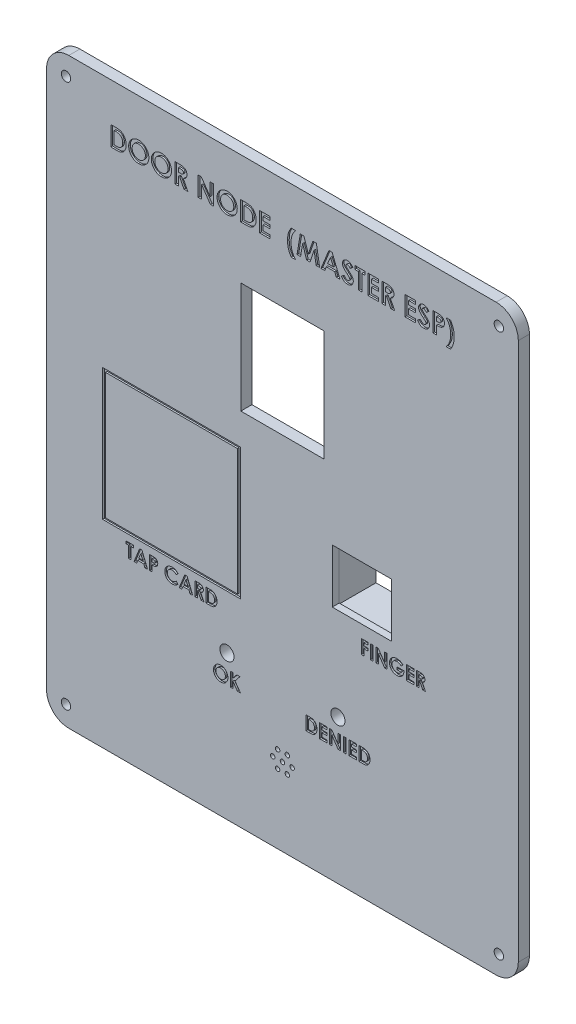
from build123d import *

# Parameters (mm, degrees)
PANEL_DEPTH                    = 4
SKETCH2_R                      = 1.7
SCREW_HOLES_DEPTH              = 227.585524692
SKETCH3_W                      = 30
SKETCH3_H                      = 2
SKETCH3_W_2                    = 2
SKETCH3_H_2                    = 30
LOCATING_TABS_DEPTH            = 3
SKETCH4_W                      = 30
SKETCH4_H                      = 40
TFT_WINDOW_DEPTH               = 227.585524692
SKETCH5_R                      = 2.1
TFT_BOSSES_DEPTH               = 2.4
SKETCH6_R                      = 1.1
TFT_PILOT_HOLES_DEPTH          = 4
SKETCH7_W                      = 43.6
SKETCH7_H                      = 41.4
SKETCH7_R                      = 3
NFC_POCKET_DEPTH               = 2.5
SKETCH8_R                      = 1.1
NFC_PILOT_HOLES_DEPTH          = 3
SKETCH9_W                      = 49.6
SKETCH9_H                      = 47.4
NFC_TAP_OUTLINE_RECESS_DEPTH   = 0.6
SKETCH10_W                     = 47.6
SKETCH10_H                     = 45.4
NFC_TAP_OUTLINE_FILL_DEPTH     = 0.6
SKETCH11_W                     = 44.6
SKETCH11_H                     = 20.5
FINGERPRINT_POCKET_DEPTH       = 1.5
SKETCH12_W                     = 21.4
SKETCH12_H                     = 19.4
FINGERPRINT_APERTURE_DEPTH     = 227.585524692
SKETCH13_W                     = 46.6
SKETCH13_H                     = 2
FINGERPRINT_CRADLE_SIDES_DEPTH = 12
SKETCH14_W                     = 2
SKETCH14_H                     = 20.5
FINGERPRINT_CRADLE_END_DEPTH   = 12
SKETCH15_W                     = 4
SKETCH15_H                     = 2.5
FINGERPRINT_TIE_SLOTS_DEPTH    = 139.15593545
SKETCH16_R                     = 2.55
LED_HOLES_DEPTH                = 227.867802916
SKETCH17_R                     = 0.8
BUZZER_SOUND_HOLES_DEPTH       = 227.867802916
SKETCH18_R                     = 7.85
SKETCH18_R_2                   = 6.25
BUZZER_CRADLE_DEPTH            = 7
SKETCH19_W                     = 0.897435897
SKETCH19_H                     = 5
SKETCH19_W_2                   = 0.897435898
LABELS_ENGRAVED_DEPTH          = 0.6


with BuildPart() as part:
    # Sketch1 → Panel (new body)
    with BuildSketch(Plane.XY):
        with BuildLine():
            Line((-77, 0), (77, 0))
            ThreePointArc((77, 0), (82.656854249, 2.343145751), (85, 8))
            Line((85, 8), (85, 202))
            ThreePointArc((85, 202), (82.656854249, 207.656854249), (77, 210))
            Line((77, 210), (-77, 210))
            ThreePointArc((-77, 210), (-82.656854249, 207.656854249), (-85, 202))
            Line((-85, 202), (-85, 8))
            ThreePointArc((-85, 8), (-82.656854249, 2.343145751), (-77, 0))
        make_face()
    extrude(amount=PANEL_DEPTH)

    # Sketch2 → Screw holes (cut, through all)
    with BuildSketch(Plane.XY):
        with Locations((-78, 7)):
            Circle(SKETCH2_R)
        with Locations((78, 7)):
            Circle(SKETCH2_R)
        with Locations((-78, 203)):
            Circle(SKETCH2_R)
        with Locations((78, 203)):
            Circle(SKETCH2_R)
    extrude(amount=SCREW_HOLES_DEPTH, mode=Mode.SUBTRACT)

    # Sketch3 → Locating tabs (add)
    with BuildSketch(Plane.XY.offset(-3)):
        with Locations((0, 4.3)):
            Rectangle(SKETCH3_W, SKETCH3_H)
        with Locations((0, 205.7)):
            Rectangle(SKETCH3_W, SKETCH3_H)
        with Locations((-80.7, 105)):
            Rectangle(SKETCH3_W_2, SKETCH3_H_2)
        with Locations((80.7, 105)):
            Rectangle(SKETCH3_W_2, SKETCH3_H_2)
    extrude(amount=LOCATING_TABS_DEPTH)

    # Sketch4 → TFT window (cut, through all)
    with BuildSketch(Plane.XY):
        with Locations((0, 150)):
            Rectangle(SKETCH4_W, SKETCH4_H)
    extrude(amount=TFT_WINDOW_DEPTH, mode=Mode.SUBTRACT)

    # Sketch5 → TFT bosses (add)
    with BuildSketch(Plane.XY.offset(-2.4)):
        with Locations((-14.25, 124)):
            Circle(SKETCH5_R)
        with Locations((-14.25, 176)):
            Circle(SKETCH5_R)
        with Locations((14.25, 124)):
            Circle(SKETCH5_R)
        with Locations((14.25, 176)):
            Circle(SKETCH5_R)
    extrude(amount=TFT_BOSSES_DEPTH)

    # Sketch6 → TFT pilot holes (cut)
    with BuildSketch(Plane.XY.offset(-2.4)):
        with Locations((-14.25, 124)):
            Circle(SKETCH6_R)
        with Locations((-14.25, 176)):
            Circle(SKETCH6_R)
        with Locations((14.25, 124)):
            Circle(SKETCH6_R)
        with Locations((14.25, 176)):
            Circle(SKETCH6_R)
    extrude(amount=TFT_PILOT_HOLES_DEPTH, mode=Mode.SUBTRACT)

    # Sketch7 → NFC pocket (cut)
    with BuildSketch(Plane.XY):
        with Locations((-40, 95)):
            Rectangle(SKETCH7_W, SKETCH7_H)
        with Locations((-53.9, 82.4)):
            Circle(SKETCH7_R, mode=Mode.SUBTRACT)
        with Locations((-53.9, 107.6)):
            Circle(SKETCH7_R, mode=Mode.SUBTRACT)
        with Locations((-26.1, 82.4)):
            Circle(SKETCH7_R, mode=Mode.SUBTRACT)
        with Locations((-26.1, 107.6)):
            Circle(SKETCH7_R, mode=Mode.SUBTRACT)
    extrude(amount=NFC_POCKET_DEPTH, mode=Mode.SUBTRACT)

    # Sketch8 → NFC pilot holes (cut)
    with BuildSketch(Plane.XY):
        with Locations((-53.9, 82.4)):
            Circle(SKETCH8_R)
        with Locations((-53.9, 107.6)):
            Circle(SKETCH8_R)
        with Locations((-26.1, 82.4)):
            Circle(SKETCH8_R)
        with Locations((-26.1, 107.6)):
            Circle(SKETCH8_R)
    extrude(amount=NFC_PILOT_HOLES_DEPTH, mode=Mode.SUBTRACT)

    # Sketch9 → NFC tap outline recess (cut)
    with BuildSketch(Plane.XY.offset(4)):
        with Locations((-40, 95)):
            Rectangle(SKETCH9_W, SKETCH9_H)
    extrude(amount=-NFC_TAP_OUTLINE_RECESS_DEPTH, mode=Mode.SUBTRACT)

    # Sketch10 → NFC tap outline fill (add)
    with BuildSketch(Plane.XY.offset(3.4)):
        with Locations((-40, 95)):
            Rectangle(SKETCH10_W, SKETCH10_H)
    extrude(amount=NFC_TAP_OUTLINE_FILL_DEPTH)

    # Sketch11 → Fingerprint pocket (cut)
    with BuildSketch(Plane.XY):
        with Locations((40, 95)):
            Rectangle(SKETCH11_W, SKETCH11_H)
    extrude(amount=FINGERPRINT_POCKET_DEPTH, mode=Mode.SUBTRACT)

    # Sketch12 → Fingerprint aperture (cut, through all)
    with BuildSketch(Plane.XY):
        with Locations((28.65, 95)):
            Rectangle(SKETCH12_W, SKETCH12_H)
    extrude(amount=FINGERPRINT_APERTURE_DEPTH, mode=Mode.SUBTRACT)

    # Sketch13 → Fingerprint cradle sides (add)
    with BuildSketch(Plane.XY.offset(-12)):
        with Locations((39, 106.25)):
            Rectangle(SKETCH13_W, SKETCH13_H)
        with Locations((39, 83.75)):
            Rectangle(SKETCH13_W, SKETCH13_H)
    extrude(amount=FINGERPRINT_CRADLE_SIDES_DEPTH)

    # Sketch14 → Fingerprint cradle end (add)
    with BuildSketch(Plane.XY.offset(-12)):
        with Locations((16.7, 95)):
            Rectangle(SKETCH14_W, SKETCH14_H)
    extrude(amount=FINGERPRINT_CRADLE_END_DEPTH)

    # Sketch15 → Fingerprint tie slots (cut, through all)
    with BuildSketch(Plane(origin=(0, 108.25, 0), x_dir=(1, 0, 0), z_dir=(0, 1, 0))):
        with Locations((30, 9.25)):
            Rectangle(SKETCH15_W, SKETCH15_H)
        with Locations((50, 9.25)):
            Rectangle(SKETCH15_W, SKETCH15_H)
    extrude(amount=-FINGERPRINT_TIE_SLOTS_DEPTH, mode=Mode.SUBTRACT)

    # Sketch16 → LED holes (cut, through all)
    with BuildSketch(Plane.XY):
        with Locations((-20, 52)):
            Circle(SKETCH16_R)
        with Locations((20, 52)):
            Circle(SKETCH16_R)
    extrude(amount=LED_HOLES_DEPTH, mode=Mode.SUBTRACT)

    # Sketch17 → Buzzer sound holes (cut, through all)
    with BuildSketch(Plane.XY):
        with Locations((0, 28)):
            Circle(SKETCH17_R)
        with Locations((3.5, 28)):
            Circle(SKETCH17_R)
        with Locations((1.75, 31.031088913)):
            Circle(SKETCH17_R)
        with Locations((-1.75, 31.031088913)):
            Circle(SKETCH17_R)
        with Locations((-3.5, 28)):
            Circle(SKETCH17_R)
        with Locations((-1.75, 24.968911087)):
            Circle(SKETCH17_R)
        with Locations((1.75, 24.968911087)):
            Circle(SKETCH17_R)
    extrude(amount=BUZZER_SOUND_HOLES_DEPTH, mode=Mode.SUBTRACT)

    # Sketch18 → Buzzer cradle (add)
    with BuildSketch(Plane.XY.offset(-7)):
        with Locations((0, 28)):
            Circle(SKETCH18_R)
        with Locations((0, 28)):
            Circle(SKETCH18_R_2, mode=Mode.SUBTRACT)
    extrude(amount=BUZZER_CRADLE_DEPTH)

    # Sketch19 → Labels (engraved) (cut)
    # profile 1 of 40: a face of its own
    with BuildSketch(Plane.XY.offset(4)):
        with BuildLine():
            Line((-61.878205128, 196), (-60.295072115, 196))
            add(Edge.make_bspline(
                [(-60.295072115, 196), (-60.171648688, 195.999137228), (-59.933069807, 195.99746948), (-59.587416207, 195.97867797), (-59.266002345, 195.949777963), (-58.96862103, 195.910020765), (-58.695881942, 195.857411104), (-58.448136773, 195.791422597), (-58.224554031, 195.715249843), (-58.022682176, 195.625617141), (-57.83839259, 195.521114312), (-57.663403746, 195.404706551), (-57.498059231, 195.2721295), (-57.340038697, 195.125940836), (-57.191381431, 194.963466082), (-57.049611757, 194.787396408), (-56.918200842, 194.595178561), (-56.793176416, 194.391421319), (-56.680108459, 194.175261178), (-56.581486362, 193.948538048), (-56.498870033, 193.712710978), (-56.431739988, 193.467528636), (-56.378229595, 193.213804954), (-56.340789451, 192.951027941), (-56.317643581, 192.679440884), (-56.315295626, 192.495373), (-56.314102564, 192.401842949)],
                knots=[0, 0, 0, 0, 1.44355588, 2.790409838, 4.047694926, 5.217575253, 6.298404546, 7.294384826, 8.214239204, 9.058592145, 9.873746385, 10.689560431, 11.514393297, 12.350027578, 13.205127629, 14.088021785, 14.991911688, 15.926770944, 16.882954281, 17.842803888, 18.816321264, 19.80318086, 20.814351908, 21.847355356, 22.906180909, 24, 24, 24, 24], degree=3))
            add(Edge.make_bspline(
                [(-56.314102564, 192.401842949), (-56.317226644, 192.269865958), (-56.323376578, 192.010061526), (-56.375180185, 191.628801515), (-56.458964158, 191.263325768), (-56.576772035, 190.916493178), (-56.722822265, 190.591392341), (-56.897295619, 190.293756274), (-57.097633912, 190.025182535), (-57.321503191, 189.787008403), (-57.563899097, 189.582294508), (-57.815797323, 189.406972038), (-58.079651816, 189.268715641), (-58.312144499, 189.181040411), (-58.51374466, 189.126514003), (-58.690747421, 189.09428837), (-58.891804497, 189.064735522), (-59.118790571, 189.041897717), (-59.370709904, 189.021532006), (-59.648566649, 189.010466072), (-59.951461187, 189.001271924), (-60.161850083, 189.000435084), (-60.271233974, 189)],
                knots=[0, 0, 0, 0, 1.315458931, 2.589557908, 3.828601765, 5.048913369, 6.235739168, 7.376350998, 8.481830359, 9.569842114, 10.627874879, 11.640079404, 12.624025415, 13.590060155, 14.111227486, 14.704434459, 15.382649715, 16.137166398, 16.978595427, 17.902333227, 18.909396075, 20, 20, 20, 20], degree=3))
            Line((-60.271233974, 189), (-61.878205128, 189))
            Line((-61.878205128, 189), (-61.878205128, 196))
        make_face()
        with BuildLine():
            Line((-60.621794872, 194.743589744), (-60.621794872, 190.256410256))
            Line((-60.621794872, 190.256410256), (-59.965544872, 190.256410256))
            add(Edge.make_bspline(
                [(-59.965544872, 190.256410256), (-59.8874612, 190.256553338), (-59.737280306, 190.256828532), (-59.520453089, 190.269936239), (-59.319942892, 190.283092763), (-59.136301671, 190.308064285), (-58.968192945, 190.335880803), (-58.817926085, 190.374591297), (-58.682403439, 190.415253392), (-58.563280391, 190.467021279), (-58.454173385, 190.52528948), (-58.35315276, 190.593557434), (-58.255639573, 190.669366421), (-58.163456912, 190.754946093), (-58.076255888, 190.849163213), (-57.994552437, 190.952503241), (-57.917256034, 191.064650884), (-57.846350732, 191.186199093), (-57.781557088, 191.315864292), (-57.724077865, 191.452390485), (-57.676419107, 191.596914641), (-57.636808066, 191.748083839), (-57.608501485, 191.907214179), (-57.585083188, 192.073127006), (-57.573010374, 192.246479651), (-57.571353456, 192.364434585), (-57.570512821, 192.424278846)],
                knots=[0, 0, 0, 0, 1.50275155, 2.890291501, 4.180787663, 5.369391935, 6.45668281, 7.458360028, 8.354766181, 9.177074746, 9.954075863, 10.732690366, 11.5210699, 12.329727389, 13.151100085, 13.990027547, 14.863562427, 15.770965086, 16.696477834, 17.652329173, 18.619756807, 19.62365428, 20.657822005, 21.729286259, 22.847956731, 24, 24, 24, 24], degree=3))
            add(Edge.make_bspline(
                [(-57.570512821, 192.424278846), (-57.57218708, 192.51598452), (-57.575451757, 192.694803477), (-57.606935596, 192.955257193), (-57.658185278, 193.200513383), (-57.731313638, 193.429661837), (-57.823494201, 193.643346583), (-57.938879664, 193.839757258), (-58.072504281, 194.02219329), (-58.178170982, 194.129216121), (-58.230969551, 194.182692308)],
                knots=[0, 0, 0, 0, 1.13821349, 2.219428113, 3.251817212, 4.244760574, 5.201143372, 6.134805572, 7.068016741, 8, 8, 8, 8], degree=3))
            add(Edge.make_bspline(
                [(-58.230969551, 194.182692308), (-58.28303394, 194.228261248), (-58.389369557, 194.32133065), (-58.576059959, 194.432851594), (-58.781783112, 194.530833674), (-59.011245346, 194.608522537), (-59.26222901, 194.669962201), (-59.536228969, 194.712335635), (-59.831777893, 194.739564355), (-60.036527301, 194.742219201), (-60.142227564, 194.743589744)],
                knots=[0, 0, 0, 0, 0.813307809, 1.661089106, 2.549956539, 3.493439533, 4.508053171, 5.589449661, 6.755572447, 8, 8, 8, 8], degree=3))
            Line((-60.142227564, 194.743589744), (-60.621794872, 194.743589744))
        make_face(mode=Mode.SUBTRACT)
    # profile 2 of 40: a face of its own
    with BuildSketch(Plane.XY.offset(4)):
        with BuildLine():
            add(Edge.make_bspline(
                [(-51.768028846, 196.179487179), (-51.646325267, 196.176336056), (-51.406054837, 196.170115024), (-51.052703739, 196.11825787), (-50.712184621, 196.033764071), (-50.384651466, 195.916311579), (-50.070924379, 195.762719183), (-49.76989674, 195.57734133), (-49.482646814, 195.356679122), (-49.212118109, 195.105880246), (-48.962100795, 194.833147419), (-48.745460646, 194.539502043), (-48.560717875, 194.232552764), (-48.407602572, 193.911477103), (-48.29097677, 193.574051457), (-48.20913562, 193.221996252), (-48.156556736, 192.855411644), (-48.150509356, 192.605817493), (-48.147435897, 192.478966346)],
                knots=[0, 0, 0, 0, 1.014329547, 2.002516266, 2.970391464, 3.935626869, 4.897733899, 5.877609409, 6.878433252, 7.912639331, 8.949961323, 9.958554974, 10.949718813, 11.932905612, 12.9188844, 13.919928257, 14.942845884, 16, 16, 16, 16], degree=3))
            add(Edge.make_bspline(
                [(-48.147435897, 192.478966346), (-48.150708997, 192.353544519), (-48.157158746, 192.106396785), (-48.20698912, 191.743190399), (-48.290208485, 191.394906439), (-48.404856222, 191.060756556), (-48.555194593, 190.742359259), (-48.736334678, 190.437681624), (-48.953056422, 190.149551132), (-49.197455132, 189.878122407), (-49.4665169, 189.631742596), (-49.751496027, 189.414620814), (-50.051076653, 189.230640009), (-50.364820288, 189.079884454), (-50.693399741, 188.962888619), (-51.036003381, 188.880339557), (-51.392610006, 188.830172825), (-51.635119804, 188.823765206), (-51.758213141, 188.820512821)],
                knots=[0, 0, 0, 0, 1.051557043, 2.072126891, 3.067553643, 4.050577992, 5.02905126, 6.015227836, 7.017913613, 8.04756643, 9.074058332, 10.072836633, 11.047628519, 12.017157415, 12.98668631, 13.966869689, 14.968021931, 16, 16, 16, 16], degree=3))
            add(Edge.make_bspline(
                [(-51.758213141, 188.820512821), (-51.886954012, 188.82343037), (-52.139912225, 188.829162956), (-52.510117702, 188.883677235), (-52.864806538, 188.965794782), (-53.200999142, 189.088350815), (-53.522119348, 189.241556163), (-53.825807792, 189.430237733), (-54.111962415, 189.654083716), (-54.378941786, 189.907361332), (-54.620825743, 190.184502596), (-54.83433578, 190.477277765), (-55.014436234, 190.783450294), (-55.161133692, 191.103163478), (-55.276784075, 191.434430378), (-55.35836228, 191.779268505), (-55.406552472, 192.136850811), (-55.413265086, 192.379727861), (-55.416666667, 192.502804487)],
                knots=[0, 0, 0, 0, 1.067978421, 2.098431617, 3.099715153, 4.085208694, 5.062210972, 6.048429807, 7.046490867, 8.072918869, 9.098532598, 10.095778865, 11.076610158, 12.041847152, 13.011192615, 13.984257998, 14.978533688, 16, 16, 16, 16], degree=3))
            add(Edge.make_bspline(
                [(-55.416666667, 192.502804487), (-55.415599055, 192.585603998), (-55.413477349, 192.750154589), (-55.387919171, 192.994010164), (-55.351122743, 193.233106006), (-55.296702571, 193.466488836), (-55.230595972, 193.695805061), (-55.144945534, 193.918920149), (-55.047452157, 194.138217583), (-54.933540326, 194.351107186), (-54.806881383, 194.555630195), (-54.668685201, 194.750821839), (-54.518604285, 194.934321967), (-54.357122096, 195.107336465), (-54.183682145, 195.268728097), (-54.000565856, 195.420781585), (-53.804221838, 195.55945785), (-53.598947446, 195.68814364), (-53.38589997, 195.804511969), (-53.165946706, 195.90356121), (-52.943619127, 195.990059226), (-52.715947234, 196.058327284), (-52.485370939, 196.113930903), (-52.249426999, 196.150702531), (-52.010247036, 196.176260001), (-51.848959853, 196.1784089), (-51.768028846, 196.179487179)],
                knots=[0, 0, 0, 0, 1.034744296, 2.056386356, 3.06226378, 4.057406941, 5.050368692, 6.043467995, 7.042652155, 8.049140477, 9.059438543, 10.048523776, 11.036952808, 12.020949711, 13.004946614, 13.997082645, 14.994316842, 16.007702937, 17.024872941, 18.026463647, 19.021641123, 20.005082605, 20.995858141, 21.984425357, 22.988620895, 24, 24, 24, 24], degree=3))
        make_face()
        with BuildLine():
            add(Edge.make_bspline(
                [(-51.787660256, 194.923076923), (-51.869566749, 194.920879188), (-52.031217389, 194.916541738), (-52.268329439, 194.883496239), (-52.495965381, 194.83071882), (-52.712863338, 194.754271373), (-52.919963366, 194.656973176), (-53.117632588, 194.539164201), (-53.303133694, 194.396794894), (-53.478940162, 194.237508431), (-53.637752377, 194.060026704), (-53.778067979, 193.86982485), (-53.895489537, 193.667220503), (-53.993830828, 193.454095808), (-54.067860025, 193.228054236), (-54.120588802, 192.990866394), (-54.153911421, 192.742123597), (-54.158111778, 192.572555955), (-54.16025641, 192.485977564)],
                knots=[0, 0, 0, 0, 1.033739768, 2.040188636, 3.016340934, 3.979330865, 4.937572243, 5.900995986, 6.878200029, 7.884839167, 8.891893314, 9.879764717, 10.863503415, 11.843163062, 12.837761627, 13.859916423, 14.907309254, 16, 16, 16, 16], degree=3))
            add(Edge.make_bspline(
                [(-54.16025641, 192.485977564), (-54.157412956, 192.390029231), (-54.151840256, 192.201986397), (-54.112630061, 191.927674577), (-54.045545321, 191.668614288), (-53.948676261, 191.426072556), (-53.828533212, 191.197356136), (-53.679334613, 190.985268273), (-53.503496776, 190.788539084), (-53.36803273, 190.673680389), (-53.299278846, 190.615384615)],
                knots=[0, 0, 0, 0, 1.078454662, 2.113592447, 3.107694534, 4.079536787, 5.043276885, 6.005368276, 6.987637804, 8, 8, 8, 8], degree=3))
            add(Edge.make_bspline(
                [(-53.299278846, 190.615384615), (-53.242956289, 190.572317936), (-53.131580132, 190.487154878), (-52.953799536, 190.378000948), (-52.770720529, 190.284445142), (-52.580961551, 190.208853157), (-52.384923361, 190.149393772), (-52.182632844, 190.107755343), (-51.974376628, 190.081623627), (-51.833544014, 190.078500392), (-51.762419872, 190.076923077)],
                knots=[0, 0, 0, 0, 1.023928204, 2.024787132, 3.009472467, 3.9914905, 4.972207045, 5.96565515, 6.972602802, 8, 8, 8, 8], degree=3))
            add(Edge.make_bspline(
                [(-51.762419872, 190.076923077), (-51.681921763, 190.079139446), (-51.523539203, 190.083500223), (-51.290841122, 190.116138914), (-51.067909293, 190.171375364), (-50.853359736, 190.247152187), (-50.647811116, 190.345672047), (-50.452268005, 190.467135087), (-50.266387563, 190.610049899), (-50.09080507, 190.771428142), (-49.930314371, 190.949609024), (-49.790291579, 191.140825395), (-49.669136601, 191.340864187), (-49.572840319, 191.552556644), (-49.495886396, 191.773904489), (-49.443792238, 192.005888025), (-49.410188118, 192.247550926), (-49.405986577, 192.412011071), (-49.403846154, 192.495793269)],
                knots=[0, 0, 0, 0, 1.026359118, 2.019393844, 2.989460624, 3.950973911, 4.916101784, 5.890408035, 6.881132271, 7.902007068, 8.92769091, 9.933912415, 10.920395702, 11.90457117, 12.894218921, 13.903490204, 14.931958862, 16, 16, 16, 16], degree=3))
            add(Edge.make_bspline(
                [(-49.403846154, 192.495793269), (-49.406060636, 192.579093697), (-49.410419507, 192.743057885), (-49.443115644, 192.984099473), (-49.498001799, 193.215058869), (-49.574006171, 193.436313255), (-49.67105973, 193.648079541), (-49.791076301, 193.849613034), (-49.933634762, 194.040718898), (-50.095454137, 194.22009482), (-50.271584581, 194.384929803), (-50.460678212, 194.527976604), (-50.657443977, 194.652279726), (-50.866396644, 194.749653772), (-51.083261215, 194.827231469), (-51.309361009, 194.884360798), (-51.545552394, 194.916309592), (-51.706238277, 194.920801039), (-51.787660256, 194.923076923)],
                knots=[0, 0, 0, 0, 1.055025985, 2.07665775, 3.074803781, 4.057872707, 5.035505728, 6.020516407, 7.023567878, 8.050795229, 9.077271434, 10.074415901, 11.050397877, 12.019801805, 12.988065821, 13.964604439, 14.968634123, 16, 16, 16, 16], degree=3))
        make_face(mode=Mode.SUBTRACT)
    # profile 3 of 40: a face of its own
    with BuildSketch(Plane.XY.offset(4)):
        with BuildLine():
            add(Edge.make_bspline(
                [(-43.601362179, 196.179487179), (-43.479658601, 196.176336056), (-43.23938817, 196.170115024), (-42.886037072, 196.11825787), (-42.545517955, 196.033764071), (-42.2179848, 195.916311579), (-41.904257713, 195.762719183), (-41.603230073, 195.57734133), (-41.315980147, 195.356679122), (-41.045451442, 195.105880246), (-40.795434128, 194.833147419), (-40.57879398, 194.539502043), (-40.394051209, 194.232552764), (-40.240935906, 193.911477103), (-40.124310103, 193.574051457), (-40.042468953, 193.221996252), (-39.989890069, 192.855411644), (-39.983842689, 192.605817493), (-39.980769231, 192.478966346)],
                knots=[0, 0, 0, 0, 1.014329547, 2.002516266, 2.970391464, 3.935626869, 4.897733899, 5.877609409, 6.878433252, 7.912639331, 8.949961323, 9.958554974, 10.949718813, 11.932905612, 12.9188844, 13.919928257, 14.942845884, 16, 16, 16, 16], degree=3))
            add(Edge.make_bspline(
                [(-39.980769231, 192.478966346), (-39.984042331, 192.353544519), (-39.990492079, 192.106396785), (-40.040322453, 191.743190399), (-40.123541818, 191.394906439), (-40.238189556, 191.060756556), (-40.388527926, 190.742359259), (-40.569668012, 190.437681624), (-40.786389756, 190.149551132), (-41.030788465, 189.878122407), (-41.299850234, 189.631742596), (-41.58482936, 189.414620814), (-41.884409986, 189.230640009), (-42.198153622, 189.079884454), (-42.526733075, 188.962888619), (-42.869336714, 188.880339557), (-43.225943339, 188.830172825), (-43.468453138, 188.823765206), (-43.591546474, 188.820512821)],
                knots=[0, 0, 0, 0, 1.051557043, 2.072126891, 3.067553643, 4.050577992, 5.02905126, 6.015227836, 7.017913613, 8.04756643, 9.074058332, 10.072836633, 11.047628519, 12.017157415, 12.98668631, 13.966869689, 14.968021931, 16, 16, 16, 16], degree=3))
            add(Edge.make_bspline(
                [(-43.591546474, 188.820512821), (-43.720287345, 188.82343037), (-43.973245558, 188.829162956), (-44.343451036, 188.883677235), (-44.698139872, 188.965794782), (-45.034332476, 189.088350815), (-45.355452682, 189.241556163), (-45.659141126, 189.430237733), (-45.945295748, 189.654083716), (-46.212275119, 189.907361332), (-46.454159076, 190.184502596), (-46.667669114, 190.477277765), (-46.847769567, 190.783450294), (-46.994467025, 191.103163478), (-47.110117408, 191.434430378), (-47.191695613, 191.779268505), (-47.239885805, 192.136850811), (-47.246598419, 192.379727861), (-47.25, 192.502804487)],
                knots=[0, 0, 0, 0, 1.067978421, 2.098431617, 3.099715153, 4.085208694, 5.062210972, 6.048429807, 7.046490867, 8.072918869, 9.098532598, 10.095778865, 11.076610158, 12.041847152, 13.011192615, 13.984257998, 14.978533688, 16, 16, 16, 16], degree=3))
            add(Edge.make_bspline(
                [(-47.25, 192.502804487), (-47.248932388, 192.585603998), (-47.246810682, 192.750154589), (-47.221252504, 192.994010164), (-47.184456076, 193.233106006), (-47.130035904, 193.466488836), (-47.063929305, 193.695805061), (-46.978278868, 193.918920149), (-46.880785491, 194.138217583), (-46.766873659, 194.351107186), (-46.640214717, 194.555630195), (-46.502018534, 194.750821839), (-46.351937618, 194.934321967), (-46.190455429, 195.107336465), (-46.017015479, 195.268728097), (-45.833899189, 195.420781585), (-45.637555171, 195.55945785), (-45.43228078, 195.68814364), (-45.219233303, 195.804511969), (-44.99928004, 195.90356121), (-44.77695246, 195.990059226), (-44.549280568, 196.058327284), (-44.318704272, 196.113930903), (-44.082760333, 196.150702531), (-43.843580369, 196.176260001), (-43.682293187, 196.1784089), (-43.601362179, 196.179487179)],
                knots=[0, 0, 0, 0, 1.034744296, 2.056386356, 3.06226378, 4.057406941, 5.050368692, 6.043467995, 7.042652155, 8.049140477, 9.059438543, 10.048523776, 11.036952808, 12.020949711, 13.004946614, 13.997082645, 14.994316842, 16.007702937, 17.024872941, 18.026463647, 19.021641123, 20.005082605, 20.995858141, 21.984425357, 22.988620895, 24, 24, 24, 24], degree=3))
        make_face()
        with BuildLine():
            add(Edge.make_bspline(
                [(-43.62099359, 194.923076923), (-43.702900082, 194.920879188), (-43.864550722, 194.916541738), (-44.101662773, 194.883496239), (-44.329298714, 194.83071882), (-44.546196672, 194.754271373), (-44.753296699, 194.656973176), (-44.950965921, 194.539164201), (-45.136467027, 194.396794894), (-45.312273496, 194.237508431), (-45.47108571, 194.060026704), (-45.611401312, 193.86982485), (-45.728822871, 193.667220503), (-45.827164162, 193.454095808), (-45.901193358, 193.228054236), (-45.953922135, 192.990866394), (-45.987244754, 192.742123597), (-45.991445112, 192.572555955), (-45.993589744, 192.485977564)],
                knots=[0, 0, 0, 0, 1.033739768, 2.040188636, 3.016340934, 3.979330865, 4.937572243, 5.900995986, 6.878200029, 7.884839167, 8.891893314, 9.879764717, 10.863503415, 11.843163062, 12.837761627, 13.859916423, 14.907309254, 16, 16, 16, 16], degree=3))
            add(Edge.make_bspline(
                [(-45.993589744, 192.485977564), (-45.990746289, 192.390029231), (-45.985173589, 192.201986397), (-45.945963394, 191.927674577), (-45.878878654, 191.668614288), (-45.782009594, 191.426072556), (-45.661866545, 191.197356136), (-45.512667947, 190.985268273), (-45.336830109, 190.788539084), (-45.201366064, 190.673680389), (-45.132612179, 190.615384615)],
                knots=[0, 0, 0, 0, 1.078454662, 2.113592447, 3.107694534, 4.079536787, 5.043276885, 6.005368276, 6.987637804, 8, 8, 8, 8], degree=3))
            add(Edge.make_bspline(
                [(-45.132612179, 190.615384615), (-45.076289622, 190.572317936), (-44.964913465, 190.487154878), (-44.78713287, 190.378000948), (-44.604053863, 190.284445142), (-44.414294884, 190.208853157), (-44.218256695, 190.149393772), (-44.015966177, 190.107755343), (-43.807709961, 190.081623627), (-43.666877347, 190.078500392), (-43.595753205, 190.076923077)],
                knots=[0, 0, 0, 0, 1.023928204, 2.024787132, 3.009472467, 3.9914905, 4.972207045, 5.96565515, 6.972602802, 8, 8, 8, 8], degree=3))
            add(Edge.make_bspline(
                [(-43.595753205, 190.076923077), (-43.515255097, 190.079139446), (-43.356872537, 190.083500223), (-43.124174456, 190.116138914), (-42.901242626, 190.171375364), (-42.686693069, 190.247152187), (-42.481144449, 190.345672047), (-42.285601338, 190.467135087), (-42.099720896, 190.610049899), (-41.924138403, 190.771428142), (-41.763647704, 190.949609024), (-41.623624912, 191.140825395), (-41.502469935, 191.340864187), (-41.406173652, 191.552556644), (-41.32921973, 191.773904489), (-41.277125571, 192.005888025), (-41.243521452, 192.247550926), (-41.239319911, 192.412011071), (-41.237179487, 192.495793269)],
                knots=[0, 0, 0, 0, 1.026359118, 2.019393844, 2.989460624, 3.950973911, 4.916101784, 5.890408035, 6.881132271, 7.902007068, 8.92769091, 9.933912415, 10.920395702, 11.90457117, 12.894218921, 13.903490204, 14.931958862, 16, 16, 16, 16], degree=3))
            add(Edge.make_bspline(
                [(-41.237179487, 192.495793269), (-41.23939397, 192.579093697), (-41.24375284, 192.743057885), (-41.276448978, 192.984099473), (-41.331335132, 193.215058869), (-41.407339505, 193.436313255), (-41.504393063, 193.648079541), (-41.624409635, 193.849613034), (-41.766968095, 194.040718898), (-41.92878747, 194.22009482), (-42.104917915, 194.384929803), (-42.294011546, 194.527976604), (-42.490777311, 194.652279726), (-42.699729977, 194.749653772), (-42.916594548, 194.827231469), (-43.142694342, 194.884360798), (-43.378885727, 194.916309592), (-43.53957161, 194.920801039), (-43.62099359, 194.923076923)],
                knots=[0, 0, 0, 0, 1.055025985, 2.07665775, 3.074803781, 4.057872707, 5.035505728, 6.020516407, 7.023567878, 8.050795229, 9.077271434, 10.074415901, 11.050397877, 12.019801805, 12.988065821, 13.964604439, 14.968634123, 16, 16, 16, 16], degree=3))
        make_face(mode=Mode.SUBTRACT)
    # profile 4 of 40: a face of its own
    with BuildSketch(Plane.XY.offset(4)):
        with BuildLine():
            Line((-38.724358974, 196), (-37.260416667, 196))
            add(Edge.make_bspline(
                [(-37.260416667, 196), (-37.163650526, 195.999656536), (-36.977541979, 195.998995957), (-36.70918362, 195.988573778), (-36.462659562, 195.97407046), (-36.237604804, 195.951938011), (-36.034115627, 195.92259306), (-35.851988089, 195.888000219), (-35.691227513, 195.848574259), (-35.550478104, 195.799446403), (-35.423458723, 195.744030927), (-35.305059001, 195.680357528), (-35.192666864, 195.60913523), (-35.087033531, 195.528489982), (-34.987241025, 195.439872572), (-34.893101081, 195.343193798), (-34.805943984, 195.237633864), (-34.726309413, 195.123859774), (-34.653728912, 195.00417204), (-34.589582972, 194.878406331), (-34.537419387, 194.746475184), (-34.491327268, 194.610285291), (-34.458128607, 194.467889789), (-34.435039425, 194.320674922), (-34.418134429, 194.16812248), (-34.417162472, 194.064485124), (-34.416666667, 194.01161859)],
                knots=[0, 0, 0, 0, 1.749336639, 3.364467119, 4.854658419, 6.213483162, 7.451590619, 8.570285859, 9.5643256, 10.440900261, 11.26203566, 12.067320669, 12.869050712, 13.665104639, 14.467235401, 15.27997916, 16.102287765, 16.939272006, 17.78853747, 18.631303466, 19.488103222, 20.351255419, 21.228522269, 22.127379805, 23.044756219, 24, 24, 24, 24], degree=3))
            add(Edge.make_bspline(
                [(-34.416666667, 194.01161859), (-34.417954591, 193.956438073), (-34.420479976, 193.848239136), (-34.434083073, 193.689303722), (-34.458945261, 193.537245435), (-34.496602662, 193.392509483), (-34.539884954, 193.253294458), (-34.597439299, 193.122168965), (-34.662395066, 192.997225972), (-34.739541132, 192.880232847), (-34.824205171, 192.768590938), (-34.922667667, 192.666577661), (-35.028549764, 192.568710188), (-35.147803479, 192.481118607), (-35.275171997, 192.397880289), (-35.413185998, 192.322444207), (-35.560944754, 192.252914069), (-35.664826478, 192.214139262), (-35.717948718, 192.194310897)],
                knots=[0, 0, 0, 0, 1.099860209, 2.156625411, 3.176576793, 4.16617041, 5.135385252, 6.078461593, 7.016046972, 7.938469504, 8.868247731, 9.803980173, 10.76021508, 11.73834243, 12.748633912, 13.790971185, 14.870363756, 16, 16, 16, 16], degree=3))
            Line((-35.717948718, 192.194310897), (-34.102564103, 189))
            Line((-34.102564103, 189), (-35.499198718, 189))
            Line((-35.499198718, 189), (-37.041666667, 192.051282051))
            Line((-37.041666667, 192.051282051), (-37.467948718, 192.051282051))
            Line((-37.467948718, 192.051282051), (-37.467948718, 189))
            Line((-37.467948718, 189), (-38.724358974, 189))
            Line((-38.724358974, 189), (-38.724358974, 196))
        make_face()
        with BuildLine():
            Line((-37.467948718, 193.307692308), (-36.978565705, 193.307692308))
            add(Edge.make_bspline(
                [(-36.978565705, 193.307692308), (-36.918734564, 193.308366166), (-36.804170784, 193.309656461), (-36.639413022, 193.31564138), (-36.489773682, 193.330062079), (-36.354610161, 193.348282094), (-36.233242329, 193.369319732), (-36.126752745, 193.399467944), (-36.033500566, 193.431772517), (-35.954590834, 193.471918721), (-35.887172172, 193.517573662), (-35.828960473, 193.569438811), (-35.780811051, 193.629466116), (-35.741181621, 193.696024294), (-35.710354233, 193.769702037), (-35.687852601, 193.84969053), (-35.675277517, 193.936900944), (-35.67383071, 193.997088004), (-35.673076923, 194.028445513)],
                knots=[0, 0, 0, 0, 1.688639943, 3.233382647, 4.650958383, 5.928841754, 7.082724185, 8.122798841, 9.049171256, 9.863274652, 10.613301712, 11.341792392, 12.054588806, 12.776240173, 13.521029143, 14.301969904, 15.115324896, 16, 16, 16, 16], degree=3))
            add(Edge.make_bspline(
                [(-35.673076923, 194.028445513), (-35.674502027, 194.065543735), (-35.67730138, 194.138416318), (-35.705079655, 194.243327285), (-35.749296668, 194.340429563), (-35.809906083, 194.42928442), (-35.88623576, 194.507180721), (-35.973830088, 194.575846931), (-36.074579562, 194.630143032), (-36.167865994, 194.665956162), (-36.252734842, 194.687383527), (-36.3293263, 194.70335101), (-36.418019669, 194.714667623), (-36.518881908, 194.726670906), (-36.631655916, 194.734454428), (-36.756956379, 194.740134847), (-36.894423434, 194.742458985), (-36.990251028, 194.743201972), (-37.040264423, 194.743589744)],
                knots=[0, 0, 0, 0, 1.020303359, 2.004196876, 2.966617323, 3.9489082, 4.950758222, 5.960522915, 7.003732012, 8.091992268, 8.70421221, 9.413913587, 10.24622431, 11.166358409, 12.212345909, 13.359657661, 14.621978493, 16, 16, 16, 16], degree=3))
            Line((-37.040264423, 194.743589744), (-37.467948718, 194.743589744))
            Line((-37.467948718, 194.743589744), (-37.467948718, 193.307692308))
        make_face(mode=Mode.SUBTRACT)
    # profile 5 of 40: a face of its own
    with BuildSketch(Plane.XY.offset(4)):
        Polygon((-30.378205128, 196), (-29.246594551, 196), (-26.070512821, 191.393629808), (-26.070512821, 196), (-24.814102564, 196), (-24.814102564, 189), (-25.954126603, 189), (-29.121794872, 193.592347756), (-29.121794872, 189), (-30.378205128, 189), align=None)
    # profile 6 of 40: a face of its own
    with BuildSketch(Plane.XY.offset(4)):
        with BuildLine():
            add(Edge.make_bspline(
                [(-19.909054487, 196.179487179), (-19.787350908, 196.176336056), (-19.547080478, 196.170115024), (-19.19372938, 196.11825787), (-18.853210262, 196.033764071), (-18.525677108, 195.916311579), (-18.21195002, 195.762719183), (-17.910922381, 195.57734133), (-17.623672455, 195.356679122), (-17.35314375, 195.105880246), (-17.103126436, 194.833147419), (-16.886486287, 194.539502043), (-16.701743516, 194.232552764), (-16.548628213, 193.911477103), (-16.432002411, 193.574051457), (-16.350161261, 193.221996252), (-16.297582377, 192.855411644), (-16.291534997, 192.605817493), (-16.288461538, 192.478966346)],
                knots=[0, 0, 0, 0, 1.014329547, 2.002516266, 2.970391464, 3.935626869, 4.897733899, 5.877609409, 6.878433252, 7.912639331, 8.949961323, 9.958554974, 10.949718813, 11.932905612, 12.9188844, 13.919928257, 14.942845884, 16, 16, 16, 16], degree=3))
            add(Edge.make_bspline(
                [(-16.288461538, 192.478966346), (-16.291734638, 192.353544519), (-16.298184387, 192.106396785), (-16.348014761, 191.743190399), (-16.431234126, 191.394906439), (-16.545881863, 191.060756556), (-16.696220234, 190.742359259), (-16.877360319, 190.437681624), (-17.094082063, 190.149551132), (-17.338480773, 189.878122407), (-17.607542541, 189.631742596), (-17.892521668, 189.414620814), (-18.192102294, 189.230640009), (-18.505845929, 189.079884454), (-18.834425382, 188.962888619), (-19.177029022, 188.880339557), (-19.533635647, 188.830172825), (-19.776145445, 188.823765206), (-19.899238782, 188.820512821)],
                knots=[0, 0, 0, 0, 1.051557043, 2.072126891, 3.067553643, 4.050577992, 5.02905126, 6.015227836, 7.017913613, 8.04756643, 9.074058332, 10.072836633, 11.047628519, 12.017157415, 12.98668631, 13.966869689, 14.968021931, 16, 16, 16, 16], degree=3))
            add(Edge.make_bspline(
                [(-19.899238782, 188.820512821), (-20.027979653, 188.82343037), (-20.280937866, 188.829162956), (-20.651143343, 188.883677235), (-21.005832179, 188.965794782), (-21.342024783, 189.088350815), (-21.663144989, 189.241556163), (-21.966833433, 189.430237733), (-22.252988056, 189.654083716), (-22.519967427, 189.907361332), (-22.761851384, 190.184502596), (-22.975361422, 190.477277765), (-23.155461875, 190.783450294), (-23.302159333, 191.103163478), (-23.417809716, 191.434430378), (-23.499387921, 191.779268505), (-23.547578113, 192.136850811), (-23.554290727, 192.379727861), (-23.557692308, 192.502804487)],
                knots=[0, 0, 0, 0, 1.067978421, 2.098431617, 3.099715153, 4.085208694, 5.062210972, 6.048429807, 7.046490867, 8.072918869, 9.098532598, 10.095778865, 11.076610158, 12.041847152, 13.011192615, 13.984257998, 14.978533688, 16, 16, 16, 16], degree=3))
            add(Edge.make_bspline(
                [(-23.557692308, 192.502804487), (-23.556624696, 192.585603998), (-23.55450299, 192.750154589), (-23.528944812, 192.994010164), (-23.492148384, 193.233106006), (-23.437728212, 193.466488836), (-23.371621613, 193.695805061), (-23.285971175, 193.918920149), (-23.188477798, 194.138217583), (-23.074565967, 194.351107186), (-22.947907024, 194.555630195), (-22.809710842, 194.750821839), (-22.659629926, 194.934321967), (-22.498147737, 195.107336465), (-22.324707786, 195.268728097), (-22.141591497, 195.420781585), (-21.945247479, 195.55945785), (-21.739973087, 195.68814364), (-21.526925611, 195.804511969), (-21.306972347, 195.90356121), (-21.084644768, 195.990059226), (-20.856972875, 196.058327284), (-20.62639658, 196.113930903), (-20.390452641, 196.150702531), (-20.151272677, 196.176260001), (-19.989985494, 196.1784089), (-19.909054487, 196.179487179)],
                knots=[0, 0, 0, 0, 1.034744296, 2.056386356, 3.06226378, 4.057406941, 5.050368692, 6.043467995, 7.042652155, 8.049140477, 9.059438543, 10.048523776, 11.036952808, 12.020949711, 13.004946614, 13.997082645, 14.994316842, 16.007702937, 17.024872941, 18.026463647, 19.021641123, 20.005082605, 20.995858141, 21.984425357, 22.988620895, 24, 24, 24, 24], degree=3))
        make_face()
        with BuildLine():
            add(Edge.make_bspline(
                [(-19.928685897, 194.923076923), (-20.01059239, 194.920879188), (-20.17224303, 194.916541738), (-20.40935508, 194.883496239), (-20.636991022, 194.83071882), (-20.853888979, 194.754271373), (-21.060989007, 194.656973176), (-21.258658229, 194.539164201), (-21.444159335, 194.396794894), (-21.619965803, 194.237508431), (-21.778778018, 194.060026704), (-21.91909362, 193.86982485), (-22.036515179, 193.667220503), (-22.134856469, 193.454095808), (-22.208885666, 193.228054236), (-22.261614443, 192.990866394), (-22.294937062, 192.742123597), (-22.299137419, 192.572555955), (-22.301282051, 192.485977564)],
                knots=[0, 0, 0, 0, 1.033739768, 2.040188636, 3.016340934, 3.979330865, 4.937572243, 5.900995986, 6.878200029, 7.884839167, 8.891893314, 9.879764717, 10.863503415, 11.843163062, 12.837761627, 13.859916423, 14.907309254, 16, 16, 16, 16], degree=3))
            add(Edge.make_bspline(
                [(-22.301282051, 192.485977564), (-22.298438597, 192.390029231), (-22.292865897, 192.201986397), (-22.253655702, 191.927674577), (-22.186570962, 191.668614288), (-22.089701902, 191.426072556), (-21.969558853, 191.197356136), (-21.820360254, 190.985268273), (-21.644522417, 190.788539084), (-21.509058371, 190.673680389), (-21.440304487, 190.615384615)],
                knots=[0, 0, 0, 0, 1.078454662, 2.113592447, 3.107694534, 4.079536787, 5.043276885, 6.005368276, 6.987637804, 8, 8, 8, 8], degree=3))
            add(Edge.make_bspline(
                [(-21.440304487, 190.615384615), (-21.38398193, 190.572317936), (-21.272605773, 190.487154878), (-21.094825177, 190.378000948), (-20.91174617, 190.284445142), (-20.721987192, 190.208853157), (-20.525949002, 190.149393772), (-20.323658485, 190.107755343), (-20.115402269, 190.081623627), (-19.974569655, 190.078500392), (-19.903445513, 190.076923077)],
                knots=[0, 0, 0, 0, 1.023928204, 2.024787132, 3.009472467, 3.9914905, 4.972207045, 5.96565515, 6.972602802, 8, 8, 8, 8], degree=3))
            add(Edge.make_bspline(
                [(-19.903445513, 190.076923077), (-19.822947404, 190.079139446), (-19.664564844, 190.083500223), (-19.431866763, 190.116138914), (-19.208934934, 190.171375364), (-18.994385377, 190.247152187), (-18.788836757, 190.345672047), (-18.593293646, 190.467135087), (-18.407413204, 190.610049899), (-18.231830711, 190.771428142), (-18.071340012, 190.949609024), (-17.93131722, 191.140825395), (-17.810162242, 191.340864187), (-17.71386596, 191.552556644), (-17.636912037, 191.773904489), (-17.584817879, 192.005888025), (-17.551213759, 192.247550926), (-17.547012218, 192.412011071), (-17.544871795, 192.495793269)],
                knots=[0, 0, 0, 0, 1.026359118, 2.019393844, 2.989460624, 3.950973911, 4.916101784, 5.890408035, 6.881132271, 7.902007068, 8.92769091, 9.933912415, 10.920395702, 11.90457117, 12.894218921, 13.903490204, 14.931958862, 16, 16, 16, 16], degree=3))
            add(Edge.make_bspline(
                [(-17.544871795, 192.495793269), (-17.547086277, 192.579093697), (-17.551445148, 192.743057885), (-17.584141285, 192.984099473), (-17.63902744, 193.215058869), (-17.715031812, 193.436313255), (-17.812085371, 193.648079541), (-17.932101942, 193.849613034), (-18.074660403, 194.040718898), (-18.236479778, 194.22009482), (-18.412610222, 194.384929803), (-18.601703853, 194.527976604), (-18.798469619, 194.652279726), (-19.007422285, 194.749653772), (-19.224286856, 194.827231469), (-19.45038665, 194.884360798), (-19.686578035, 194.916309592), (-19.847263918, 194.920801039), (-19.928685897, 194.923076923)],
                knots=[0, 0, 0, 0, 1.055025985, 2.07665775, 3.074803781, 4.057872707, 5.035505728, 6.020516407, 7.023567878, 8.050795229, 9.077271434, 10.074415901, 11.050397877, 12.019801805, 12.988065821, 13.964604439, 14.968634123, 16, 16, 16, 16], degree=3))
        make_face(mode=Mode.SUBTRACT)
    # profile 7 of 40: a face of its own
    with BuildSketch(Plane.XY.offset(4)):
        with BuildLine():
            Line((-15.032051282, 196), (-13.448918269, 196))
            add(Edge.make_bspline(
                [(-13.448918269, 196), (-13.325494842, 195.999137228), (-13.086915961, 195.99746948), (-12.741262361, 195.97867797), (-12.419848499, 195.949777963), (-12.122467184, 195.910020765), (-11.849728096, 195.857411104), (-11.601982927, 195.791422597), (-11.378400184, 195.715249843), (-11.17652833, 195.625617141), (-10.992238744, 195.521114312), (-10.8172499, 195.404706551), (-10.651905385, 195.2721295), (-10.49388485, 195.125940836), (-10.345227584, 194.963466082), (-10.203457911, 194.787396408), (-10.072046995, 194.595178561), (-9.947022569, 194.391421319), (-9.833954613, 194.175261178), (-9.735332516, 193.948538048), (-9.652716187, 193.712710978), (-9.585586142, 193.467528636), (-9.532075749, 193.213804954), (-9.494635605, 192.951027941), (-9.471489735, 192.679440884), (-9.46914178, 192.495373), (-9.467948718, 192.401842949)],
                knots=[0, 0, 0, 0, 1.44355588, 2.790409838, 4.047694926, 5.217575253, 6.298404546, 7.294384826, 8.214239204, 9.058592145, 9.873746385, 10.689560431, 11.514393297, 12.350027578, 13.205127629, 14.088021785, 14.991911688, 15.926770944, 16.882954281, 17.842803888, 18.816321264, 19.80318086, 20.814351908, 21.847355356, 22.906180909, 24, 24, 24, 24], degree=3))
            add(Edge.make_bspline(
                [(-9.467948718, 192.401842949), (-9.471072798, 192.269865958), (-9.477222731, 192.010061526), (-9.529026339, 191.628801515), (-9.612810312, 191.263325768), (-9.730618188, 190.916493178), (-9.876668419, 190.591392341), (-10.051141773, 190.293756274), (-10.251480066, 190.025182535), (-10.475349345, 189.787008403), (-10.717745251, 189.582294508), (-10.969643477, 189.406972038), (-11.23349797, 189.268715641), (-11.465990653, 189.181040411), (-11.667590814, 189.126514003), (-11.844593575, 189.09428837), (-12.045650651, 189.064735522), (-12.272636724, 189.041897717), (-12.524556057, 189.021532006), (-12.802412803, 189.010466072), (-13.105307341, 189.001271924), (-13.315696237, 189.000435084), (-13.425080128, 189)],
                knots=[0, 0, 0, 0, 1.315458931, 2.589557908, 3.828601765, 5.048913369, 6.235739168, 7.376350998, 8.481830359, 9.569842114, 10.627874879, 11.640079404, 12.624025415, 13.590060155, 14.111227486, 14.704434459, 15.382649715, 16.137166398, 16.978595427, 17.902333227, 18.909396075, 20, 20, 20, 20], degree=3))
            Line((-13.425080128, 189), (-15.032051282, 189))
            Line((-15.032051282, 189), (-15.032051282, 196))
        make_face()
        with BuildLine():
            Line((-13.775641026, 194.743589744), (-13.775641026, 190.256410256))
            Line((-13.775641026, 190.256410256), (-13.119391026, 190.256410256))
            add(Edge.make_bspline(
                [(-13.119391026, 190.256410256), (-13.041307354, 190.256553338), (-12.891126459, 190.256828532), (-12.674299243, 190.269936239), (-12.473789046, 190.283092763), (-12.290147825, 190.308064285), (-12.122039099, 190.335880803), (-11.971772239, 190.374591297), (-11.836249593, 190.415253392), (-11.717126545, 190.467021279), (-11.608019539, 190.52528948), (-11.506998913, 190.593557434), (-11.409485727, 190.669366421), (-11.317303066, 190.754946093), (-11.230102041, 190.849163213), (-11.148398591, 190.952503241), (-11.071102188, 191.064650884), (-11.000196886, 191.186199093), (-10.935403242, 191.315864292), (-10.877924019, 191.452390485), (-10.830265261, 191.596914641), (-10.790654219, 191.748083839), (-10.762347639, 191.907214179), (-10.738929342, 192.073127006), (-10.726856528, 192.246479651), (-10.725199609, 192.364434585), (-10.724358974, 192.424278846)],
                knots=[0, 0, 0, 0, 1.50275155, 2.890291501, 4.180787663, 5.369391935, 6.45668281, 7.458360028, 8.354766181, 9.177074746, 9.954075863, 10.732690366, 11.5210699, 12.329727389, 13.151100085, 13.990027547, 14.863562427, 15.770965086, 16.696477834, 17.652329173, 18.619756807, 19.62365428, 20.657822005, 21.729286259, 22.847956731, 24, 24, 24, 24], degree=3))
            add(Edge.make_bspline(
                [(-10.724358974, 192.424278846), (-10.726033234, 192.51598452), (-10.729297911, 192.694803477), (-10.760781749, 192.955257193), (-10.812031432, 193.200513383), (-10.885159791, 193.429661837), (-10.977340355, 193.643346583), (-11.092725818, 193.839757258), (-11.226350435, 194.02219329), (-11.332017136, 194.129216121), (-11.384815705, 194.182692308)],
                knots=[0, 0, 0, 0, 1.13821349, 2.219428113, 3.251817212, 4.244760574, 5.201143372, 6.134805572, 7.068016741, 8, 8, 8, 8], degree=3))
            add(Edge.make_bspline(
                [(-11.384815705, 194.182692308), (-11.436880093, 194.228261248), (-11.543215711, 194.32133065), (-11.729906112, 194.432851594), (-11.935629266, 194.530833674), (-12.1650915, 194.608522537), (-12.416075164, 194.669962201), (-12.690075123, 194.712335635), (-12.985624047, 194.739564355), (-13.190373455, 194.742219201), (-13.296073718, 194.743589744)],
                knots=[0, 0, 0, 0, 0.813307809, 1.661089106, 2.549956539, 3.493439533, 4.508053171, 5.589449661, 6.755572447, 8, 8, 8, 8], degree=3))
            Line((-13.296073718, 194.743589744), (-13.775641026, 194.743589744))
        make_face(mode=Mode.SUBTRACT)
    # profile 8 of 40: a face of its own
    with BuildSketch(Plane.XY.offset(4)):
        Polygon((-8.211538462, 196), (-4.442307692, 196), (-4.442307692, 194.743589744), (-6.955128205, 194.743589744), (-6.955128205, 193.397435897), (-4.442307692, 193.397435897), (-4.442307692, 192.141025641), (-6.955128205, 192.141025641), (-6.955128205, 190.256410256), (-4.442307692, 190.256410256), (-4.442307692, 189), (-8.211538462, 189), align=None)
    # profile 9 of 40: a face of its own
    with BuildSketch(Plane.XY.offset(4)):
        with BuildLine():
            Line((3.142427885, 196.179487179), (4.711538462, 196.179487179))
            add(Edge.make_bspline(
                [(4.711538462, 196.179487179), (4.644807353, 196.102104022), (4.512307572, 195.948453774), (4.329472803, 195.707669825), (4.157518724, 195.46351904), (3.998904322, 195.213617835), (3.85333024, 194.958395008), (3.719594639, 194.699117576), (3.600278044, 194.434485776), (3.493298938, 194.164595335), (3.398858398, 193.887191234), (3.317607335, 193.60072106), (3.249156472, 193.304908572), (3.192868136, 192.999400166), (3.149633136, 192.684471212), (3.119492021, 192.35928835), (3.098518259, 192.024914812), (3.096948059, 191.79844398), (3.096153846, 191.683894231)],
                knots=[0, 0, 0, 0, 1.00236213, 1.990267575, 2.964862165, 3.931797803, 4.893137898, 5.846900052, 6.793123604, 7.740135921, 8.694427184, 9.667077551, 10.660503013, 11.672460941, 12.714089686, 13.778281025, 14.87624668, 16, 16, 16, 16], degree=3))
            add(Edge.make_bspline(
                [(3.096153846, 191.683894231), (3.097473501, 191.560000798), (3.100074921, 191.315771049), (3.121464337, 190.955056574), (3.156842317, 190.605723155), (3.203308528, 190.267103785), (3.267187061, 189.940771616), (3.342387557, 189.625005798), (3.432969916, 189.321207153), (3.5050759, 189.124923892), (3.540665064, 189.028044872)],
                knots=[0, 0, 0, 0, 1.097990858, 2.164457195, 3.201156713, 4.209415668, 5.192484095, 6.147015238, 7.085427113, 8, 8, 8, 8], degree=3))
            add(Edge.make_bspline(
                [(3.540665064, 189.028044872), (3.571188725, 188.953375688), (3.633520406, 188.80089543), (3.744399418, 188.573626986), (3.868510203, 188.341422672), (4.009141005, 188.105326037), (4.160356652, 187.862281587), (4.331880524, 187.617630774), (4.514648224, 187.366288713), (4.645099115, 187.200050592), (4.711538462, 187.115384615)],
                knots=[0, 0, 0, 0, 0.860028042, 1.756243877, 2.695094802, 3.667075869, 4.686284936, 5.746781471, 6.852423585, 8, 8, 8, 8], degree=3))
            Line((4.711538462, 187.115384615), (3.142427885, 187.115384615))
            add(Edge.make_bspline(
                [(3.142427885, 187.115384615), (3.083274744, 187.212183542), (2.967157041, 187.402199976), (2.808049796, 187.690086959), (2.6583843, 187.970356412), (2.525656324, 188.247943303), (2.403652056, 188.519192052), (2.300001928, 188.787912638), (2.204160162, 189.049638426), (2.125216965, 189.311116712), (2.057778552, 189.575618639), (1.998114626, 189.848567832), (1.950014897, 190.133223788), (1.908837614, 190.429142272), (1.878644121, 190.736534075), (1.856417662, 191.054965964), (1.84168342, 191.384610133), (1.840397198, 191.608156981), (1.83974359, 191.721754808)],
                knots=[0, 0, 0, 0, 1.119871376, 2.19830916, 3.246961562, 4.256259542, 5.235550337, 6.182491613, 7.09917337, 7.986748165, 8.877687696, 9.793695483, 10.744317876, 11.727190303, 12.742913882, 13.793068013, 14.878522868, 16, 16, 16, 16], degree=3))
            add(Edge.make_bspline(
                [(1.83974359, 191.721754808), (1.840277136, 191.833020304), (1.841329083, 192.052392565), (1.85784083, 192.375953161), (1.881590512, 192.689220406), (1.912609277, 192.992096385), (1.957170152, 193.284149783), (2.008107696, 193.565990961), (2.07006716, 193.837305787), (2.141928901, 194.10030167), (2.225596761, 194.358262892), (2.319625039, 194.615706173), (2.426387281, 194.873895838), (2.54605131, 195.133074715), (2.676369157, 195.394356437), (2.8193296, 195.656373274), (2.975331295, 195.918784533), (3.08630572, 196.091925867), (3.142427885, 196.179487179)],
                knots=[0, 0, 0, 0, 1.13127193, 2.230428031, 3.293392423, 4.325815098, 5.325330466, 6.296707414, 7.23754678, 8.15420938, 9.068070667, 9.994306547, 10.940496973, 11.908145907, 12.896524899, 13.908929949, 14.942500703, 16, 16, 16, 16], degree=3))
        make_face()
    # profile 10 of 40: a face of its own
    with BuildSketch(Plane.XY.offset(4)):
        Polygon((6.432091346, 196), (7.733373397, 196), (9.333333333, 191.117387821), (10.941706731, 196), (12.233173077, 196), (13.416666667, 189), (12.144831731, 189), (11.397435897, 193.421274038), (9.941907051, 189), (8.717748397, 189), (7.269230769, 193.421274038), (6.523237179, 189), (5.25, 189), align=None)
    # profile 11 of 40: a face of its own
    with BuildSketch(Plane.XY.offset(4)):
        Polygon((16.735777244, 196), (17.903846154, 196), (20.730769231, 189), (19.388822115, 189), (18.844751603, 190.435897436), (15.797676282, 190.435897436), (15.252203526, 189), (13.91025641, 189), align=None)
        Polygon((17.320512821, 194.122395833), (16.274439103, 191.692307692), (18.367988782, 191.692307692), align=None, mode=Mode.SUBTRACT)
    # profile 12 of 40: a face of its own
    with BuildSketch(Plane.XY.offset(4)):
        with BuildLine():
            Line((25.352564103, 195.064703526), (24.413060897, 194.205128205))
            add(Edge.make_bspline(
                [(24.413060897, 194.205128205), (24.372816609, 194.261896958), (24.295553186, 194.370885048), (24.170317238, 194.516822668), (24.045646794, 194.641318319), (23.920386858, 194.743851915), (23.793427175, 194.823800488), (23.664988127, 194.880404961), (23.535797872, 194.916388962), (23.449001963, 194.920869836), (23.40625, 194.923076923)],
                knots=[0, 0, 0, 0, 1.299362458, 2.494594718, 3.587462134, 4.587049575, 5.512617175, 6.380583204, 7.202344345, 8, 8, 8, 8], degree=3))
            add(Edge.make_bspline(
                [(23.40625, 194.923076923), (23.366372195, 194.921678411), (23.28937863, 194.918978252), (23.179618592, 194.892138875), (23.082172067, 194.84581805), (22.997134158, 194.785249675), (22.929771588, 194.712278825), (22.8759878, 194.635751166), (22.845703008, 194.551281937), (22.841716933, 194.493265063), (22.83974359, 194.464543269)],
                knots=[0, 0, 0, 0, 1.185010067, 2.2879431, 3.333075148, 4.379039566, 5.372662701, 6.27520591, 7.14612461, 8, 8, 8, 8], degree=3))
            add(Edge.make_bspline(
                [(22.83974359, 194.464543269), (22.840980184, 194.435407294), (22.843470513, 194.376731489), (22.867523701, 194.29073479), (22.903778723, 194.206706004), (22.938421876, 194.155553683), (22.956129808, 194.129407051)],
                knots=[0, 0, 0, 0, 0.967525499, 1.948461899, 2.951351359, 4, 4, 4, 4], degree=3))
            add(Edge.make_bspline(
                [(22.956129808, 194.129407051), (22.972228233, 194.109083548), (23.009284682, 194.062301527), (23.07994374, 193.988206099), (23.168676678, 193.897432714), (23.278898125, 193.793102802), (23.406032486, 193.671464252), (23.555972603, 193.537298722), (23.724402546, 193.386451262), (23.844118647, 193.281406552), (23.906850962, 193.226362179)],
                knots=[0, 0, 0, 0, 0.473873513, 1.090794244, 1.870441696, 2.795289791, 3.865433203, 5.087734844, 6.473946851, 8, 8, 8, 8], degree=3))
            add(Edge.make_bspline(
                [(23.906850962, 193.226362179), (23.965734262, 193.175401653), (24.077482534, 193.07868916), (24.236478134, 192.941421305), (24.376208785, 192.817924763), (24.498710046, 192.710052952), (24.602124915, 192.616674051), (24.68688815, 192.53734171), (24.75403499, 192.473600383), (24.792204036, 192.435100582), (24.80849359, 192.418669872)],
                knots=[0, 0, 0, 0, 1.543621617, 2.929473131, 4.163658386, 5.240097082, 6.164993805, 6.925417477, 7.541396219, 8, 8, 8, 8], degree=3))
            add(Edge.make_bspline(
                [(24.80849359, 192.418669872), (24.870292759, 192.351789936), (24.989092464, 192.223223211), (25.143490202, 192.023985221), (25.270564534, 191.829488318), (25.368871648, 191.636072726), (25.443117133, 191.440947843), (25.495461185, 191.239328243), (25.526810385, 191.029107127), (25.530290878, 190.885656878), (25.532051282, 190.813100962)],
                knots=[0, 0, 0, 0, 1.206664779, 2.319633467, 3.337109185, 4.282041471, 5.190008762, 6.099243693, 7.03861361, 8, 8, 8, 8], degree=3))
            add(Edge.make_bspline(
                [(25.532051282, 190.813100962), (25.530798272, 190.742404119), (25.528339819, 190.603694282), (25.498228483, 190.400713097), (25.455291486, 190.206451294), (25.388903357, 190.023022715), (25.307989898, 189.847416437), (25.206553191, 189.682367846), (25.087429687, 189.526206584), (24.950895861, 189.381724223), (24.799873237, 189.250616496), (24.63788712, 189.1339013), (24.463353528, 189.03753804), (24.277763649, 188.958189768), (24.081216824, 188.897074668), (23.8739472, 188.851904913), (23.655637745, 188.824794738), (23.506354593, 188.821960691), (23.430088141, 188.820512821)],
                knots=[0, 0, 0, 0, 1.043214005, 2.046824704, 3.02475056, 3.976699089, 4.921714032, 5.875962561, 6.831408892, 7.817874052, 8.806269674, 9.781291748, 10.760897367, 11.74438705, 12.757449933, 13.795994037, 14.874007457, 16, 16, 16, 16], degree=3))
            add(Edge.make_bspline(
                [(23.430088141, 188.820512821), (23.370219625, 188.821574928), (23.25164563, 188.82367851), (23.076885487, 188.840852503), (22.908134814, 188.868569501), (22.745583692, 188.908296239), (22.588499801, 188.958635404), (22.436876689, 189.020122766), (22.291761061, 189.093711356), (22.152054903, 189.1778879), (22.01843736, 189.275627955), (21.88921889, 189.384933258), (21.765683014, 189.507484974), (21.647236414, 189.642993272), (21.534636945, 189.79184188), (21.424198821, 189.951957804), (21.320830246, 190.126312581), (21.256974878, 190.248623867), (21.224358974, 190.311097756)],
                knots=[0, 0, 0, 0, 1.016823716, 2.013894106, 2.979844003, 3.91962641, 4.853723003, 5.779685073, 6.695824784, 7.614987388, 8.547259901, 9.504950863, 10.487499108, 11.500346958, 12.559593716, 13.656357062, 14.802919212, 16, 16, 16, 16], degree=3))
            Line((21.224358974, 190.311097756), (22.329326923, 190.974358974))
            add(Edge.make_bspline(
                [(22.329326923, 190.974358974), (22.370124544, 190.903442947), (22.448337071, 190.767490861), (22.58087551, 190.584822003), (22.716654374, 190.428396363), (22.858812749, 190.300978775), (23.005622042, 190.200865502), (23.157791377, 190.129317611), (23.315427665, 190.085029548), (23.422802343, 190.079620952), (23.476362179, 190.076923077)],
                knots=[0, 0, 0, 0, 1.283663364, 2.460892379, 3.537111102, 4.529833553, 5.449777664, 6.316464042, 7.160231139, 8, 8, 8, 8], degree=3))
            add(Edge.make_bspline(
                [(23.476362179, 190.076923077), (23.530840201, 190.079126308), (23.636535498, 190.083400898), (23.787402009, 190.122883992), (23.925722138, 190.184875346), (24.045285037, 190.273328461), (24.146523361, 190.375416799), (24.221243055, 190.488994743), (24.268182471, 190.611883336), (24.273145105, 190.697249837), (24.275641026, 190.740184295)],
                knots=[0, 0, 0, 0, 1.13588714, 2.203786484, 3.234766741, 4.283437687, 5.291419208, 6.222934724, 7.106237994, 8, 8, 8, 8], degree=3))
            add(Edge.make_bspline(
                [(24.275641026, 190.740184295), (24.273336145, 190.780127821), (24.268654001, 190.861269272), (24.234166769, 190.981913561), (24.180252707, 191.102502983), (24.116468569, 191.20141369), (24.051560223, 191.284228944), (23.989493203, 191.355984615), (23.913911992, 191.435262069), (23.82500823, 191.522161032), (23.723956568, 191.617446496), (23.610671882, 191.721109132), (23.483856944, 191.832235795), (23.394223895, 191.907934181), (23.347355769, 191.947516026)],
                knots=[0, 0, 0, 0, 0.916159276, 1.861089862, 2.860218735, 3.940849679, 4.552606315, 5.27541173, 6.11797699, 7.06649574, 8.129236253, 9.306560635, 10.591630461, 12, 12, 12, 12], degree=3))
            add(Edge.make_bspline(
                [(23.347355769, 191.947516026), (23.258257596, 192.022901624), (23.087251235, 192.167589404), (22.84559755, 192.3812887), (22.627845942, 192.581010274), (22.435877149, 192.76922312), (22.267245191, 192.942451383), (22.123092116, 193.10210209), (22.005001512, 193.249406727), (21.880736614, 193.423879212), (21.762660117, 193.636485924), (21.660608516, 193.892276445), (21.594401744, 194.14803451), (21.586984196, 194.319736388), (21.583333333, 194.404246795)],
                knots=[0, 0, 0, 0, 1.345494975, 2.582412109, 3.71882943, 4.751509156, 5.681369928, 6.505683931, 7.230279997, 7.856715994, 8.973648664, 10.023341002, 11.027102913, 12, 12, 12, 12], degree=3))
            add(Edge.make_bspline(
                [(21.583333333, 194.404246795), (21.584851722, 194.46417704), (21.587843112, 194.582246059), (21.614526766, 194.75584935), (21.654406505, 194.923361939), (21.712323334, 195.084172663), (21.787492386, 195.238080101), (21.878782279, 195.385837695), (21.987610573, 195.526085518), (22.110252713, 195.658730593), (22.245372951, 195.779953098), (22.389766098, 195.886944105), (22.542614874, 195.977310265), (22.702984228, 196.052275556), (22.871867902, 196.109656724), (23.048021739, 196.150331357), (23.231698399, 196.174523331), (23.356631298, 196.177811949), (23.420272436, 196.179487179)],
                knots=[0, 0, 0, 0, 1.010766082, 1.991317756, 2.957454644, 3.913069143, 4.869106762, 5.843196583, 6.838735724, 7.860187025, 8.887984031, 9.89767229, 10.887916223, 11.879572884, 12.879850636, 13.892031539, 14.926195476, 16, 16, 16, 16], degree=3))
            add(Edge.make_bspline(
                [(23.420272436, 196.179487179), (23.502748201, 196.17647004), (23.667048697, 196.170459578), (23.909971718, 196.123459728), (24.147248769, 196.049547513), (24.338451064, 195.960380557), (24.49058716, 195.874004485), (24.607185267, 195.794480278), (24.725830117, 195.703381025), (24.847478506, 195.600419648), (24.96987002, 195.483656219), (25.096484835, 195.355870384), (25.225597669, 195.215957775), (25.30950054, 195.116004855), (25.352564103, 195.064703526)],
                knots=[0, 0, 0, 0, 1.282922637, 2.555718331, 3.837320111, 5.142675274, 5.830281639, 6.55870424, 7.337177975, 8.157850921, 9.037902056, 9.96903443, 10.957596896, 12, 12, 12, 12], degree=3))
        make_face()
    # profile 13 of 40: a face of its own
    with BuildSketch(Plane.XY.offset(4)):
        Polygon((26.070512821, 196), (29.83974359, 196), (29.83974359, 194.743589744), (28.583333333, 194.743589744), (28.583333333, 189), (27.326923077, 189), (27.326923077, 194.743589744), (26.070512821, 194.743589744), align=None)
    # profile 14 of 40: a face of its own
    with BuildSketch(Plane.XY.offset(4)):
        Polygon((30.826923077, 196), (34.596153846, 196), (34.596153846, 194.743589744), (32.083333333, 194.743589744), (32.083333333, 193.397435897), (34.596153846, 193.397435897), (34.596153846, 192.141025641), (32.083333333, 192.141025641), (32.083333333, 190.256410256), (34.596153846, 190.256410256), (34.596153846, 189), (30.826923077, 189), align=None)
    # profile 15 of 40: a face of its own
    with BuildSketch(Plane.XY.offset(4)):
        with BuildLine():
            Line((35.852564103, 196), (37.31650641, 196))
            add(Edge.make_bspline(
                [(37.31650641, 196), (37.413272551, 195.999656536), (37.599381098, 195.998995957), (37.867739457, 195.988573778), (38.114263515, 195.97407046), (38.339318273, 195.951938011), (38.54280745, 195.92259306), (38.724934988, 195.888000219), (38.885695564, 195.848574259), (39.026444973, 195.799446403), (39.153464354, 195.744030927), (39.271864076, 195.680357528), (39.384256213, 195.60913523), (39.489889546, 195.528489982), (39.589682052, 195.439872572), (39.683821996, 195.343193798), (39.770979093, 195.237633864), (39.850613664, 195.123859774), (39.923194165, 195.00417204), (39.987340105, 194.878406331), (40.03950369, 194.746475184), (40.085595809, 194.610285291), (40.11879447, 194.467889789), (40.141883652, 194.320674922), (40.158788648, 194.16812248), (40.159760605, 194.064485124), (40.16025641, 194.01161859)],
                knots=[0, 0, 0, 0, 1.749336639, 3.364467119, 4.854658419, 6.213483162, 7.451590619, 8.570285859, 9.5643256, 10.440900261, 11.26203566, 12.067320669, 12.869050712, 13.665104639, 14.467235401, 15.27997916, 16.102287765, 16.939272006, 17.78853747, 18.631303466, 19.488103222, 20.351255419, 21.228522269, 22.127379805, 23.044756219, 24, 24, 24, 24], degree=3))
            add(Edge.make_bspline(
                [(40.16025641, 194.01161859), (40.158968486, 193.956438073), (40.156443101, 193.848239136), (40.142840004, 193.689303722), (40.117977816, 193.537245435), (40.080320414, 193.392509483), (40.037038123, 193.253294458), (39.979483778, 193.122168965), (39.914528011, 192.997225972), (39.837381945, 192.880232847), (39.752717906, 192.768590938), (39.65425541, 192.666577661), (39.548373313, 192.568710188), (39.429119598, 192.481118607), (39.30175108, 192.397880289), (39.163737079, 192.322444207), (39.015978323, 192.252914069), (38.912096599, 192.214139262), (38.858974359, 192.194310897)],
                knots=[0, 0, 0, 0, 1.099860209, 2.156625411, 3.176576793, 4.16617041, 5.135385252, 6.078461593, 7.016046972, 7.938469504, 8.868247731, 9.803980173, 10.76021508, 11.73834243, 12.748633912, 13.790971185, 14.870363756, 16, 16, 16, 16], degree=3))
            Line((38.858974359, 192.194310897), (40.474358974, 189))
            Line((40.474358974, 189), (39.077724359, 189))
            Line((39.077724359, 189), (37.53525641, 192.051282051))
            Line((37.53525641, 192.051282051), (37.108974359, 192.051282051))
            Line((37.108974359, 192.051282051), (37.108974359, 189))
            Line((37.108974359, 189), (35.852564103, 189))
            Line((35.852564103, 189), (35.852564103, 196))
        make_face()
        with BuildLine():
            Line((37.108974359, 193.307692308), (37.598357372, 193.307692308))
            add(Edge.make_bspline(
                [(37.598357372, 193.307692308), (37.658188513, 193.308366166), (37.772752293, 193.309656461), (37.937510055, 193.31564138), (38.087149395, 193.330062079), (38.222312916, 193.348282094), (38.343680747, 193.369319732), (38.450170332, 193.399467944), (38.543422511, 193.431772517), (38.622332243, 193.471918721), (38.689750905, 193.517573662), (38.747962604, 193.569438811), (38.796112026, 193.629466116), (38.835741456, 193.696024294), (38.866568844, 193.769702037), (38.889070476, 193.84969053), (38.90164556, 193.936900944), (38.903092367, 193.997088004), (38.903846154, 194.028445513)],
                knots=[0, 0, 0, 0, 1.688639943, 3.233382647, 4.650958383, 5.928841754, 7.082724185, 8.122798841, 9.049171256, 9.863274652, 10.613301712, 11.341792392, 12.054588806, 12.776240173, 13.521029143, 14.301969904, 15.115324896, 16, 16, 16, 16], degree=3))
            add(Edge.make_bspline(
                [(38.903846154, 194.028445513), (38.90242105, 194.065543735), (38.899621697, 194.138416318), (38.871843422, 194.243327285), (38.827626409, 194.340429563), (38.767016994, 194.42928442), (38.690687317, 194.507180721), (38.603092989, 194.575846931), (38.502343515, 194.630143032), (38.409057083, 194.665956162), (38.324188235, 194.687383527), (38.247596777, 194.70335101), (38.158903408, 194.714667623), (38.058041169, 194.726670906), (37.945267161, 194.734454428), (37.819966698, 194.740134847), (37.682499643, 194.742458985), (37.586672049, 194.743201972), (37.536658654, 194.743589744)],
                knots=[0, 0, 0, 0, 1.020303359, 2.004196876, 2.966617323, 3.9489082, 4.950758222, 5.960522915, 7.003732012, 8.091992268, 8.70421221, 9.413913587, 10.24622431, 11.166358409, 12.212345909, 13.359657661, 14.621978493, 16, 16, 16, 16], degree=3))
            Line((37.536658654, 194.743589744), (37.108974359, 194.743589744))
            Line((37.108974359, 194.743589744), (37.108974359, 193.307692308))
        make_face(mode=Mode.SUBTRACT)
    # profile 16 of 40: a face of its own
    with BuildSketch(Plane.XY.offset(4)):
        Polygon((44.198717949, 196), (47.967948718, 196), (47.967948718, 194.743589744), (45.455128205, 194.743589744), (45.455128205, 193.397435897), (47.967948718, 193.397435897), (47.967948718, 192.141025641), (45.455128205, 192.141025641), (45.455128205, 190.256410256), (47.967948718, 190.256410256), (47.967948718, 189), (44.198717949, 189), align=None)
    # profile 17 of 40: a face of its own
    with BuildSketch(Plane.XY.offset(4)):
        with BuildLine():
            Line((52.814102564, 195.064703526), (51.874599359, 194.205128205))
            add(Edge.make_bspline(
                [(51.874599359, 194.205128205), (51.83435507, 194.261896958), (51.757091648, 194.370885048), (51.631855699, 194.516822668), (51.507185255, 194.641318319), (51.38192532, 194.743851915), (51.254965636, 194.823800488), (51.126526589, 194.880404961), (50.997336334, 194.916388962), (50.910540425, 194.920869836), (50.867788462, 194.923076923)],
                knots=[0, 0, 0, 0, 1.299362458, 2.494594718, 3.587462134, 4.587049575, 5.512617175, 6.380583204, 7.202344345, 8, 8, 8, 8], degree=3))
            add(Edge.make_bspline(
                [(50.867788462, 194.923076923), (50.827910656, 194.921678411), (50.750917092, 194.918978252), (50.641157053, 194.892138875), (50.543710528, 194.84581805), (50.458672619, 194.785249675), (50.39131005, 194.712278825), (50.337526261, 194.635751166), (50.307241469, 194.551281937), (50.303255395, 194.493265063), (50.301282051, 194.464543269)],
                knots=[0, 0, 0, 0, 1.185010067, 2.2879431, 3.333075148, 4.379039566, 5.372662701, 6.27520591, 7.14612461, 8, 8, 8, 8], degree=3))
            add(Edge.make_bspline(
                [(50.301282051, 194.464543269), (50.302518646, 194.435407294), (50.305008974, 194.376731489), (50.329062162, 194.29073479), (50.365317184, 194.206706004), (50.399960338, 194.155553683), (50.417668269, 194.129407051)],
                knots=[0, 0, 0, 0, 0.967525499, 1.948461899, 2.951351359, 4, 4, 4, 4], degree=3))
            add(Edge.make_bspline(
                [(50.417668269, 194.129407051), (50.433766694, 194.109083548), (50.470823143, 194.062301527), (50.541482202, 193.988206099), (50.630215139, 193.897432714), (50.740436586, 193.793102802), (50.867570948, 193.671464252), (51.017511065, 193.537298722), (51.185941008, 193.386451262), (51.305657109, 193.281406552), (51.368389423, 193.226362179)],
                knots=[0, 0, 0, 0, 0.473873513, 1.090794244, 1.870441696, 2.795289791, 3.865433203, 5.087734844, 6.473946851, 8, 8, 8, 8], degree=3))
            add(Edge.make_bspline(
                [(51.368389423, 193.226362179), (51.427272724, 193.175401653), (51.539020996, 193.07868916), (51.698016595, 192.941421305), (51.837747247, 192.817924763), (51.960248507, 192.710052952), (52.063663376, 192.616674051), (52.148426611, 192.53734171), (52.215573451, 192.473600383), (52.253742498, 192.435100582), (52.270032051, 192.418669872)],
                knots=[0, 0, 0, 0, 1.543621617, 2.929473131, 4.163658386, 5.240097082, 6.164993805, 6.925417477, 7.541396219, 8, 8, 8, 8], degree=3))
            add(Edge.make_bspline(
                [(52.270032051, 192.418669872), (52.33183122, 192.351789936), (52.450630926, 192.223223211), (52.605028664, 192.023985221), (52.732102996, 191.829488318), (52.830410109, 191.636072726), (52.904655595, 191.440947843), (52.956999646, 191.239328243), (52.988348847, 191.029107127), (52.99182934, 190.885656878), (52.993589744, 190.813100962)],
                knots=[0, 0, 0, 0, 1.206664779, 2.319633467, 3.337109185, 4.282041471, 5.190008762, 6.099243693, 7.03861361, 8, 8, 8, 8], degree=3))
            add(Edge.make_bspline(
                [(52.993589744, 190.813100962), (52.992336733, 190.742404119), (52.98987828, 190.603694282), (52.959766945, 190.400713097), (52.916829948, 190.206451294), (52.850441818, 190.023022715), (52.769528359, 189.847416437), (52.668091652, 189.682367846), (52.548968148, 189.526206584), (52.412434323, 189.381724223), (52.261411699, 189.250616496), (52.099425582, 189.1339013), (51.92489199, 189.03753804), (51.73930211, 188.958189768), (51.542755286, 188.897074668), (51.335485662, 188.851904913), (51.117176206, 188.824794738), (50.967893055, 188.821960691), (50.891626603, 188.820512821)],
                knots=[0, 0, 0, 0, 1.043214005, 2.046824704, 3.02475056, 3.976699089, 4.921714032, 5.875962561, 6.831408892, 7.817874052, 8.806269674, 9.781291748, 10.760897367, 11.74438705, 12.757449933, 13.795994037, 14.874007457, 16, 16, 16, 16], degree=3))
            add(Edge.make_bspline(
                [(50.891626603, 188.820512821), (50.831758087, 188.821574928), (50.713184092, 188.82367851), (50.538423949, 188.840852503), (50.369673275, 188.868569501), (50.207122154, 188.908296239), (50.050038262, 188.958635404), (49.89841515, 189.020122766), (49.753299522, 189.093711356), (49.613593365, 189.1778879), (49.479975821, 189.275627955), (49.350757352, 189.384933258), (49.227221476, 189.507484974), (49.108774876, 189.642993272), (48.996175406, 189.79184188), (48.885737282, 189.951957804), (48.782368707, 190.126312581), (48.71851334, 190.248623867), (48.685897436, 190.311097756)],
                knots=[0, 0, 0, 0, 1.016823716, 2.013894106, 2.979844003, 3.91962641, 4.853723003, 5.779685073, 6.695824784, 7.614987388, 8.547259901, 9.504950863, 10.487499108, 11.500346958, 12.559593716, 13.656357062, 14.802919212, 16, 16, 16, 16], degree=3))
            Line((48.685897436, 190.311097756), (49.790865385, 190.974358974))
            add(Edge.make_bspline(
                [(49.790865385, 190.974358974), (49.831663006, 190.903442947), (49.909875533, 190.767490861), (50.042413971, 190.584822003), (50.178192835, 190.428396363), (50.32035121, 190.300978775), (50.467160504, 190.200865502), (50.619329839, 190.129317611), (50.776966126, 190.085029548), (50.884340804, 190.079620952), (50.937900641, 190.076923077)],
                knots=[0, 0, 0, 0, 1.283663364, 2.460892379, 3.537111102, 4.529833553, 5.449777664, 6.316464042, 7.160231139, 8, 8, 8, 8], degree=3))
            add(Edge.make_bspline(
                [(50.937900641, 190.076923077), (50.992378663, 190.079126308), (51.09807396, 190.083400898), (51.24894047, 190.122883992), (51.3872606, 190.184875346), (51.506823498, 190.273328461), (51.608061822, 190.375416799), (51.682781516, 190.488994743), (51.729720932, 190.611883336), (51.734683566, 190.697249837), (51.737179487, 190.740184295)],
                knots=[0, 0, 0, 0, 1.13588714, 2.203786484, 3.234766741, 4.283437687, 5.291419208, 6.222934724, 7.106237994, 8, 8, 8, 8], degree=3))
            add(Edge.make_bspline(
                [(51.737179487, 190.740184295), (51.734874607, 190.780127821), (51.730192462, 190.861269272), (51.695705231, 190.981913561), (51.641791168, 191.102502983), (51.578007031, 191.20141369), (51.513098684, 191.284228944), (51.451031665, 191.355984615), (51.375450454, 191.435262069), (51.286546691, 191.522161032), (51.185495029, 191.617446496), (51.072210344, 191.721109132), (50.945395405, 191.832235795), (50.855762357, 191.907934181), (50.808894231, 191.947516026)],
                knots=[0, 0, 0, 0, 0.916159276, 1.861089862, 2.860218735, 3.940849679, 4.552606315, 5.27541173, 6.11797699, 7.06649574, 8.129236253, 9.306560635, 10.591630461, 12, 12, 12, 12], degree=3))
            add(Edge.make_bspline(
                [(50.808894231, 191.947516026), (50.719796058, 192.022901624), (50.548789696, 192.167589404), (50.307136011, 192.3812887), (50.089384404, 192.581010274), (49.897415611, 192.76922312), (49.728783652, 192.942451383), (49.584630577, 193.10210209), (49.466539973, 193.249406727), (49.342275076, 193.423879212), (49.224198578, 193.636485924), (49.122146977, 193.892276445), (49.055940206, 194.14803451), (49.048522658, 194.319736388), (49.044871795, 194.404246795)],
                knots=[0, 0, 0, 0, 1.345494975, 2.582412109, 3.71882943, 4.751509156, 5.681369928, 6.505683931, 7.230279997, 7.856715994, 8.973648664, 10.023341002, 11.027102913, 12, 12, 12, 12], degree=3))
            add(Edge.make_bspline(
                [(49.044871795, 194.404246795), (49.046390184, 194.46417704), (49.049381573, 194.582246059), (49.076065228, 194.75584935), (49.115944966, 194.923361939), (49.173861796, 195.084172663), (49.249030847, 195.238080101), (49.34032074, 195.385837695), (49.449149034, 195.526085518), (49.571791174, 195.658730593), (49.706911413, 195.779953098), (49.851304559, 195.886944105), (50.004153335, 195.977310265), (50.164522689, 196.052275556), (50.333406364, 196.109656724), (50.509560201, 196.150331357), (50.69323686, 196.174523331), (50.818169759, 196.177811949), (50.881810897, 196.179487179)],
                knots=[0, 0, 0, 0, 1.010766082, 1.991317756, 2.957454644, 3.913069143, 4.869106762, 5.843196583, 6.838735724, 7.860187025, 8.887984031, 9.89767229, 10.887916223, 11.879572884, 12.879850636, 13.892031539, 14.926195476, 16, 16, 16, 16], degree=3))
            add(Edge.make_bspline(
                [(50.881810897, 196.179487179), (50.964286663, 196.17647004), (51.128587158, 196.170459578), (51.37151018, 196.123459728), (51.608787231, 196.049547513), (51.799989525, 195.960380557), (51.952125622, 195.874004485), (52.068723729, 195.794480278), (52.187368578, 195.703381025), (52.309016968, 195.600419648), (52.431408482, 195.483656219), (52.558023297, 195.355870384), (52.687136131, 195.215957775), (52.771039002, 195.116004855), (52.814102564, 195.064703526)],
                knots=[0, 0, 0, 0, 1.282922637, 2.555718331, 3.837320111, 5.142675274, 5.830281639, 6.55870424, 7.337177975, 8.157850921, 9.037902056, 9.96903443, 10.957596896, 12, 12, 12, 12], degree=3))
        make_face()
    # profile 18 of 40: a face of its own
    with BuildSketch(Plane.XY.offset(4)):
        with BuildLine():
            Line((54.25, 196), (55.65224359, 196))
            add(Edge.make_bspline(
                [(55.65224359, 196), (55.743864367, 195.999589886), (55.920620051, 195.99879869), (56.175516289, 195.989204385), (56.410670549, 195.972010807), (56.626028805, 195.950762263), (56.821502507, 195.920972631), (56.997336446, 195.886821151), (57.153567112, 195.845214708), (57.291956238, 195.795828437), (57.416156008, 195.737603954), (57.53368905, 195.675590722), (57.641899101, 195.601580118), (57.746247852, 195.523548689), (57.840769504, 195.434042123), (57.931360884, 195.339017213), (58.014185198, 195.234705347), (58.089626226, 195.122369193), (58.158062862, 195.004084244), (58.217853686, 194.87963904), (58.266352654, 194.74883666), (58.307037258, 194.612523247), (58.339715528, 194.470704741), (58.361467224, 194.322508947), (58.376242071, 194.168970623), (58.377545747, 194.064472343), (58.378205128, 194.01161859)],
                knots=[0, 0, 0, 0, 1.698747864, 3.27724071, 4.728299578, 6.070144658, 7.288476769, 8.393259625, 9.389771311, 10.283485332, 11.113357557, 11.931608583, 12.74405601, 13.541433047, 14.344816069, 15.154114104, 15.974336324, 16.810834471, 17.661136416, 18.50621059, 19.367396281, 20.244825668, 21.142564693, 22.063065223, 23.020325768, 24, 24, 24, 24], degree=3))
            add(Edge.make_bspline(
                [(58.378205128, 194.01161859), (58.377251086, 193.953147741), (58.375376277, 193.838245339), (58.356997105, 193.669812513), (58.325599671, 193.509227064), (58.284564867, 193.355134745), (58.227344752, 193.210070716), (58.161973457, 193.070573706), (58.08154603, 192.940554782), (57.989644836, 192.818387563), (57.889278248, 192.703078774), (57.778063567, 192.597957737), (57.658120593, 192.502307845), (57.530143633, 192.415126681), (57.393652222, 192.336590108), (57.248744847, 192.265962714), (57.094431997, 192.205503383), (56.986973171, 192.173883643), (56.932491987, 192.157852564)],
                knots=[0, 0, 0, 0, 1.102006807, 2.165578795, 3.188629044, 4.184801286, 5.166646146, 6.124351954, 7.085497154, 8.042432466, 9.003981491, 9.963833307, 10.922997304, 11.89326795, 12.880200226, 13.889073926, 14.929769137, 16, 16, 16, 16], degree=3))
            add(Edge.make_bspline(
                [(56.932491987, 192.157852564), (56.896607545, 192.148924457), (56.818870289, 192.129583302), (56.690236481, 192.109947175), (56.541999524, 192.091892963), (56.373680069, 192.076377554), (56.185181078, 192.065830691), (55.976685066, 192.05759406), (55.748097546, 192.051605179), (55.589146824, 192.051392667), (55.506410256, 192.051282051)],
                knots=[0, 0, 0, 0, 0.618981996, 1.340914327, 2.176866532, 3.120127938, 4.170906482, 5.338178032, 6.614476169, 8, 8, 8, 8], degree=3))
            Line((55.506410256, 192.051282051), (55.506410256, 189))
            Line((55.506410256, 189), (54.25, 189))
            Line((54.25, 189), (54.25, 196))
        make_face()
        with BuildLine():
            Line((55.506410256, 193.307692308), (55.950921474, 193.307692308))
            add(Edge.make_bspline(
                [(55.950921474, 193.307692308), (56.031807308, 193.308205187), (56.180638444, 193.309148892), (56.383889219, 193.322795413), (56.547225451, 193.343636408), (56.676264108, 193.373527215), (56.77815235, 193.418890472), (56.866024579, 193.471367219), (56.941394833, 193.537722624), (57.00665438, 193.613545028), (57.058827422, 193.70066877), (57.095006708, 193.79767521), (57.118508061, 193.902526139), (57.12067863, 193.975495445), (57.121794872, 194.013020833)],
                knots=[0, 0, 0, 0, 1.8619151, 3.425951444, 4.686033666, 5.651700536, 6.461346321, 7.243864085, 7.999046032, 8.762387399, 9.539336099, 10.322741239, 11.137448474, 12, 12, 12, 12], degree=3))
            add(Edge.make_bspline(
                [(57.121794872, 194.013020833), (57.120690112, 194.045806276), (57.118546612, 194.109417919), (57.102799875, 194.201225297), (57.077704108, 194.286808713), (57.041341305, 194.36527436), (56.994332812, 194.436488913), (56.937019945, 194.500424319), (56.870138142, 194.558449808), (56.81850148, 194.589163585), (56.792267628, 194.604767628)],
                knots=[0, 0, 0, 0, 1.102301479, 2.1387299, 3.123554645, 4.094223062, 5.036071848, 5.982632524, 6.975082478, 8, 8, 8, 8], degree=3))
            add(Edge.make_bspline(
                [(56.792267628, 194.604767628), (56.770046041, 194.616005722), (56.722998388, 194.639799069), (56.642871673, 194.667460575), (56.550406667, 194.690796103), (56.444979128, 194.710164365), (56.327009637, 194.725196149), (56.19651924, 194.736691702), (56.053315909, 194.741314512), (55.953726561, 194.742810415), (55.901842949, 194.743589744)],
                knots=[0, 0, 0, 0, 0.656809284, 1.390599849, 2.23162475, 3.173112763, 4.218524733, 5.370385145, 6.63003504, 8, 8, 8, 8], degree=3))
            Line((55.901842949, 194.743589744), (55.506410256, 194.743589744))
            Line((55.506410256, 194.743589744), (55.506410256, 193.307692308))
        make_face(mode=Mode.SUBTRACT)
    # profile 19 of 40: a face of its own
    with BuildSketch(Plane.XY.offset(4)):
        with BuildLine():
            Line((60.575520833, 187.115384615), (59.006410256, 187.115384615))
            add(Edge.make_bspline(
                [(59.006410256, 187.115384615), (59.073144817, 187.192765832), (59.205651451, 187.346412224), (59.388435612, 187.587224639), (59.560578434, 187.831269263), (59.718063499, 188.080876613), (59.865732091, 188.333745379), (59.996565104, 188.593398907), (60.116056468, 188.857180242), (60.223541077, 189.126426684), (60.317620967, 189.403493472), (60.399053534, 189.689920648), (60.467111499, 189.986363365), (60.525404974, 190.292051457), (60.56830602, 190.608074708), (60.598404733, 190.933715861), (60.619464822, 191.269021664), (60.621011156, 191.495960233), (60.621794872, 191.610977564)],
                knots=[0, 0, 0, 0, 1.002349761, 1.990243017, 2.964825581, 3.931749288, 4.885124716, 5.836788903, 6.783000779, 7.725738754, 8.680018241, 9.652656607, 10.646069811, 11.663363356, 12.704979249, 13.773722967, 14.871675074, 16, 16, 16, 16], degree=3))
            add(Edge.make_bspline(
                [(60.621794872, 191.610977564), (60.620477009, 191.734871223), (60.61787912, 191.979101418), (60.59646404, 192.339812654), (60.561226037, 192.688697318), (60.514512938, 193.026818562), (60.450693369, 193.352674922), (60.37606544, 193.667682306), (60.284430263, 193.970226383), (60.212793343, 194.16571733), (60.177283654, 194.262620192)],
                knots=[0, 0, 0, 0, 1.099645224, 2.167718429, 3.205979964, 4.211650066, 5.196199703, 6.152169059, 7.084049107, 8, 8, 8, 8], degree=3))
            add(Edge.make_bspline(
                [(60.177283654, 194.262620192), (60.146755508, 194.337286712), (60.084414669, 194.489761529), (59.973607701, 194.717072777), (59.849014263, 194.949458727), (59.70931533, 195.186578573), (59.557077962, 195.42990427), (59.386605859, 195.67574393), (59.202834863, 195.927294817), (59.072766375, 196.094291609), (59.006410256, 196.179487179)],
                knots=[0, 0, 0, 0, 0.858702877, 1.753537788, 2.690942094, 3.665716508, 4.683355137, 5.746314987, 6.850253485, 8, 8, 8, 8], degree=3))
            Line((59.006410256, 196.179487179), (60.575520833, 196.179487179))
            add(Edge.make_bspline(
                [(60.575520833, 196.179487179), (60.634621577, 196.082661628), (60.750636425, 195.892592927), (60.910380823, 195.605273274), (61.057356059, 195.323651868), (61.193250881, 195.047795481), (61.31185639, 194.774857577), (61.4191804, 194.507310017), (61.511613845, 194.243844767), (61.591213504, 193.982815453), (61.659295094, 193.718428108), (61.717576771, 193.445596302), (61.768639093, 193.161387657), (61.808927005, 192.86569688), (61.83935642, 192.558346909), (61.861516532, 192.239903256), (61.876269122, 191.91026234), (61.877552808, 191.686715043), (61.878205128, 191.573116987)],
                knots=[0, 0, 0, 0, 1.119955126, 2.198473562, 3.245059523, 4.256446178, 5.233948972, 6.182657628, 7.102214905, 7.989856078, 8.87639277, 9.796980209, 10.743924827, 11.726870758, 12.742670299, 13.792902966, 14.878438998, 16, 16, 16, 16], degree=3))
            add(Edge.make_bspline(
                [(61.878205128, 191.573116987), (61.877672153, 191.461851408), (61.876621332, 191.242478984), (61.860101412, 190.91891957), (61.836381336, 190.605648043), (61.805209593, 190.302327305), (61.760923751, 190.009766339), (61.709839837, 189.727475757), (61.647828816, 189.456182313), (61.5763427, 189.193527753), (61.491728245, 188.935891916), (61.398779714, 188.678056802), (61.291421918, 188.420317801), (61.17358782, 188.1607368), (61.041185023, 187.900944963), (60.898755373, 187.63843102), (60.742582138, 187.376104743), (60.631631146, 187.202951799), (60.575520833, 187.115384615)],
                knots=[0, 0, 0, 0, 1.131238154, 2.230361439, 3.293294094, 4.325685945, 5.329872518, 6.301220463, 7.242031739, 8.158666971, 9.067978702, 9.998651369, 10.944813546, 11.906133471, 12.896617558, 13.90899238, 14.942532276, 16, 16, 16, 16], degree=3))
        make_face()
    # profile 20 of 40: a face of its own
    with BuildSketch(Plane.XY.offset(4)):
        Polygon((-56.41025641, 68.8), (-53.717948718, 68.8), (-53.717948718, 67.902564103), (-54.615384615, 67.902564103), (-54.615384615, 63.8), (-55.512820513, 63.8), (-55.512820513, 67.902564103), (-56.41025641, 67.902564103), align=None)
    # profile 21 of 40: a face of its own
    with BuildSketch(Plane.XY.offset(4)):
        Polygon((-51.475360577, 68.8), (-50.641025641, 68.8), (-48.621794872, 63.8), (-49.580328526, 63.8), (-49.968950321, 64.825641026), (-52.145432692, 64.825641026), (-52.53505609, 63.8), (-53.493589744, 63.8), align=None)
        Polygon((-51.057692308, 67.458854167), (-51.804887821, 65.723076923), (-50.309495192, 65.723076923), align=None, mode=Mode.SUBTRACT)
    # profile 22 of 40: a face of its own
    with BuildSketch(Plane.XY.offset(4)):
        with BuildLine():
            Line((-47.884615385, 68.8), (-46.883012821, 68.8))
            add(Edge.make_bspline(
                [(-46.883012821, 68.8), (-46.817569408, 68.799707061), (-46.691315348, 68.799141921), (-46.509246607, 68.792288847), (-46.341279278, 68.780007719), (-46.187451952, 68.764830188), (-46.04782788, 68.743551879), (-45.922232209, 68.719157965), (-45.810638876, 68.689439077), (-45.7117895, 68.65416317), (-45.623075379, 68.612574253), (-45.539123206, 68.568279087), (-45.461830312, 68.51541437), (-45.38729549, 68.459677635), (-45.319780024, 68.395744374), (-45.255071896, 68.327869438), (-45.195911671, 68.253360962), (-45.142025223, 68.173120852), (-45.093141912, 68.088631603), (-45.05043418, 67.999742171), (-45.01579206, 67.9063119), (-44.986731629, 67.808945176), (-44.963390008, 67.707646244), (-44.947853082, 67.601792105), (-44.93729962, 67.492121874), (-44.936368422, 67.417480245), (-44.935897436, 67.379727564)],
                knots=[0, 0, 0, 0, 1.698747864, 3.27724071, 4.728299578, 6.070144658, 7.288476769, 8.393259625, 9.389771311, 10.283485332, 11.113357557, 11.931608583, 12.74405601, 13.541433047, 14.344816069, 15.154114104, 15.974336324, 16.810834471, 17.661136416, 18.50621059, 19.367396281, 20.244825668, 21.142564693, 22.063065223, 23.020325768, 24, 24, 24, 24], degree=3))
            add(Edge.make_bspline(
                [(-44.935897436, 67.379727564), (-44.936578894, 67.337962672), (-44.937918044, 67.255889528), (-44.951046024, 67.135580367), (-44.973472763, 67.020876474), (-45.002783337, 66.910810532), (-45.043654847, 66.807193369), (-45.090348629, 66.707552647), (-45.147796792, 66.614681987), (-45.213440502, 66.527419688), (-45.285130922, 66.445056267), (-45.36456998, 66.369969812), (-45.450243532, 66.301648461), (-45.541655647, 66.239376201), (-45.639149511, 66.183278649), (-45.74265478, 66.13283051), (-45.852878244, 66.089645274), (-45.929634548, 66.067059745), (-45.968549679, 66.055608974)],
                knots=[0, 0, 0, 0, 1.102006807, 2.165578795, 3.188629044, 4.184801286, 5.166646146, 6.124351954, 7.085497154, 8.042432466, 9.003981491, 9.963833307, 10.922997304, 11.89326795, 12.880200226, 13.889073926, 14.929769137, 16, 16, 16, 16], degree=3))
            add(Edge.make_bspline(
                [(-45.968549679, 66.055608974), (-45.994181424, 66.049231755), (-46.049708035, 66.035416644), (-46.141589327, 66.021390839), (-46.247472868, 66.008494974), (-46.367701049, 65.997412539), (-46.502343186, 65.989879065), (-46.651268909, 65.983995757), (-46.814545709, 65.979717985), (-46.928081939, 65.979566191), (-46.987179487, 65.979487179)],
                knots=[0, 0, 0, 0, 0.618981996, 1.340914327, 2.176866532, 3.120127938, 4.170906482, 5.338178032, 6.614476169, 8, 8, 8, 8], degree=3))
            Line((-46.987179487, 65.979487179), (-46.987179487, 63.8))
            Line((-46.987179487, 63.8), (-47.884615385, 63.8))
            Line((-47.884615385, 63.8), (-47.884615385, 68.8))
        make_face()
        with BuildLine():
            Line((-46.987179487, 66.876923077), (-46.669671474, 66.876923077))
            add(Edge.make_bspline(
                [(-46.669671474, 66.876923077), (-46.611895879, 66.877289419), (-46.505587924, 66.877963494), (-46.3604088, 66.887711009), (-46.243740062, 66.902597435), (-46.151569593, 66.923948011), (-46.078792278, 66.956350337), (-46.0160264, 66.993833728), (-45.962190504, 67.041230446), (-45.915576541, 67.095389306), (-45.878310084, 67.15762055), (-45.852467736, 67.226910865), (-45.835681055, 67.301804385), (-45.834130649, 67.353925318), (-45.833333333, 67.380729167)],
                knots=[0, 0, 0, 0, 1.8619151, 3.425951444, 4.686033666, 5.651700536, 6.461346321, 7.243864085, 7.999046032, 8.762387399, 9.539336099, 10.322741239, 11.137448474, 12, 12, 12, 12], degree=3))
            add(Edge.make_bspline(
                [(-45.833333333, 67.380729167), (-45.834122448, 67.40414734), (-45.835653519, 67.449584228), (-45.846901188, 67.515160926), (-45.864826736, 67.576291938), (-45.890800167, 67.632338828), (-45.924377662, 67.683206367), (-45.965315424, 67.728874514), (-46.01308814, 67.770321291), (-46.04997147, 67.792259704), (-46.068709936, 67.803405449)],
                knots=[0, 0, 0, 0, 1.102301479, 2.1387299, 3.123554645, 4.094223062, 5.036071848, 5.982632524, 6.975082478, 8, 8, 8, 8], degree=3))
            add(Edge.make_bspline(
                [(-46.068709936, 67.803405449), (-46.084582498, 67.811432659), (-46.118187965, 67.828427907), (-46.175421333, 67.848186125), (-46.241467765, 67.864854359), (-46.31677315, 67.878688832), (-46.401037073, 67.88942582), (-46.494244499, 67.89763693), (-46.596532593, 67.900938937), (-46.667667841, 67.902007439), (-46.704727564, 67.902564103)],
                knots=[0, 0, 0, 0, 0.656809284, 1.390599849, 2.23162475, 3.173112763, 4.218524733, 5.370385145, 6.63003504, 8, 8, 8, 8], degree=3))
            Line((-46.704727564, 67.902564103), (-46.987179487, 67.902564103))
            Line((-46.987179487, 67.902564103), (-46.987179487, 66.876923077))
        make_face(mode=Mode.SUBTRACT)
    # profile 23 of 40: a face of its own
    with BuildSketch(Plane.XY.offset(4)):
        with BuildLine():
            Line((-37.628205128, 67.932612179), (-38.286258013, 67.303605769))
            add(Edge.make_bspline(
                [(-38.286258013, 67.303605769), (-38.34207942, 67.361325197), (-38.451116115, 67.474069323), (-38.626815265, 67.62333261), (-38.809535984, 67.747723364), (-38.995723804, 67.852484465), (-39.188727706, 67.931743704), (-39.386316038, 67.989501246), (-39.589750459, 68.024713837), (-39.727427051, 68.02874278), (-39.796674679, 68.030769231)],
                knots=[0, 0, 0, 0, 1.115251505, 2.178435587, 3.19620269, 4.182487026, 5.141301733, 6.088180966, 7.038406374, 8, 8, 8, 8], degree=3))
            add(Edge.make_bspline(
                [(-39.796674679, 68.030769231), (-39.854504864, 68.029168264), (-39.968626362, 68.026008933), (-40.136186626, 68.002847918), (-40.296466678, 67.963461605), (-40.450015183, 67.90917997), (-40.596380317, 67.838942415), (-40.735868952, 67.752803302), (-40.868137186, 67.65154059), (-40.991437832, 67.535678217), (-41.10422893, 67.409089868), (-41.203887046, 67.274020401), (-41.287366704, 67.130779254), (-41.355877102, 66.980817067), (-41.409244054, 66.82343974), (-41.447354762, 66.658753228), (-41.469396977, 66.4865614), (-41.472686926, 66.369506679), (-41.474358974, 66.310016026)],
                knots=[0, 0, 0, 0, 1.035432265, 2.043311493, 3.022114605, 3.98653278, 4.95457646, 5.923598177, 6.917315552, 7.932509744, 8.948865224, 9.949768934, 10.933144597, 11.912367597, 12.897413939, 13.903909035, 14.934704909, 16, 16, 16, 16], degree=3))
            add(Edge.make_bspline(
                [(-41.474358974, 66.310016026), (-41.473877109, 66.268261323), (-41.472927343, 66.185961946), (-41.462530469, 66.064218326), (-41.445789052, 65.946098234), (-41.421560073, 65.831780589), (-41.391261496, 65.721166322), (-41.355714367, 65.613301171), (-41.311121016, 65.509675588), (-41.261621724, 65.409086031), (-41.204054618, 65.31427721), (-41.141986658, 65.223869131), (-41.074684088, 65.138304964), (-41.001710987, 65.0579345), (-40.922040349, 64.984013749), (-40.837731365, 64.914319825), (-40.747361858, 64.850597403), (-40.652809034, 64.791247299), (-40.553256074, 64.73968936), (-40.451404081, 64.692987827), (-40.345708774, 64.655059238), (-40.237457057, 64.624485336), (-40.127035784, 64.598486798), (-40.01336493, 64.5824787), (-39.897429882, 64.570355954), (-39.819077249, 64.569607445), (-39.779647436, 64.569230769)],
                knots=[0, 0, 0, 0, 1.103660481, 2.175337485, 3.227646561, 4.255952547, 5.262355991, 6.258840057, 7.255597736, 8.242457506, 9.22035537, 10.185017736, 11.140346927, 12.096287581, 13.051739095, 14.01125915, 14.986044842, 15.97314143, 16.960198552, 17.947847494, 18.933482797, 19.925264591, 20.920966487, 21.929612487, 22.958107872, 24, 24, 24, 24], degree=3))
            add(Edge.make_bspline(
                [(-39.779647436, 64.569230769), (-39.712767697, 64.571165286), (-39.581366403, 64.574966109), (-39.388516109, 64.604688005), (-39.204748991, 64.653578841), (-39.057919944, 64.711316078), (-38.942883263, 64.76833235), (-38.855307539, 64.821069593), (-38.764747415, 64.880061989), (-38.672707016, 64.947535976), (-38.578151072, 65.022681839), (-38.482748712, 65.107145412), (-38.384057619, 65.198145431), (-38.319406063, 65.263093932), (-38.286258013, 65.296394231)],
                knots=[0, 0, 0, 0, 1.404581149, 2.759636711, 4.088442092, 5.392261763, 6.066678138, 6.783632037, 7.538459478, 8.336747902, 9.180226004, 10.074962426, 11.012997595, 12, 12, 12, 12], degree=3))
            Line((-38.286258013, 65.296394231), (-37.648237179, 64.626322115))
            add(Edge.make_bspline(
                [(-37.648237179, 64.626322115), (-37.69308661, 64.583021398), (-37.780623107, 64.498507659), (-37.912669482, 64.378506035), (-38.044549672, 64.270671236), (-38.173077725, 64.171089331), (-38.300359066, 64.082661384), (-38.426380196, 64.005299079), (-38.549714501, 63.937045812), (-38.672923058, 63.879052641), (-38.796772533, 63.829810416), (-38.924199089, 63.787416092), (-39.05559228, 63.75155202), (-39.191754597, 63.722614423), (-39.331415999, 63.699410377), (-39.475883533, 63.683747781), (-39.624241202, 63.673218338), (-39.724874507, 63.67227218), (-39.775641026, 63.671794872)],
                knots=[0, 0, 0, 0, 1.244526981, 2.429050516, 3.560637417, 4.644440555, 5.67424972, 6.652764056, 7.595344123, 8.486817594, 9.369275933, 10.254498637, 11.166417451, 12.086725134, 13.032340136, 13.991389299, 14.986715468, 16, 16, 16, 16], degree=3))
            add(Edge.make_bspline(
                [(-39.775641026, 63.671794872), (-39.868892831, 63.674172046), (-40.051360694, 63.678823516), (-40.318762589, 63.713287757), (-40.572787212, 63.771066451), (-40.814052556, 63.85278146), (-41.042481905, 63.957168554), (-41.258016819, 64.08514223), (-41.460309905, 64.236362482), (-41.647727033, 64.409056861), (-41.817254744, 64.599783306), (-41.967097608, 64.804571183), (-42.091047631, 65.024426951), (-42.193966006, 65.256102637), (-42.274446822, 65.500655468), (-42.331091672, 65.758349975), (-42.366024138, 66.028937338), (-42.3698458, 66.213754744), (-42.371794872, 66.308012821)],
                knots=[0, 0, 0, 0, 1.078019885, 2.10938526, 3.111377082, 4.085535484, 5.04941344, 6.010039228, 6.978205633, 7.964457913, 8.951525778, 9.924444315, 10.892603023, 11.863865945, 12.85144698, 13.863884204, 14.910567087, 16, 16, 16, 16], degree=3))
            add(Edge.make_bspline(
                [(-42.371794872, 66.308012821), (-42.370971288, 66.369487134), (-42.369339147, 66.491314197), (-42.352185194, 66.670775332), (-42.328271585, 66.845717838), (-42.29033482, 67.014325232), (-42.244605791, 67.178868967), (-42.187735735, 67.337560644), (-42.119815482, 67.490856359), (-42.043034262, 67.639012739), (-41.956172435, 67.7810592), (-41.859138239, 67.915775339), (-41.754429712, 68.044201141), (-41.639530879, 68.164632798), (-41.516111371, 68.278127724), (-41.383613962, 68.384070869), (-41.242835558, 68.483981576), (-41.093395125, 68.57528339), (-40.938195891, 68.657870734), (-40.779195329, 68.730716299), (-40.616784083, 68.791598416), (-40.451648843, 68.842097887), (-40.283091915, 68.87979217), (-40.112316415, 68.908325527), (-39.937869249, 68.924275856), (-39.820743089, 68.926887027), (-39.76161859, 68.928205128)],
                knots=[0, 0, 0, 0, 1.071919942, 2.124283339, 3.142214191, 4.149696895, 5.136002878, 6.119640489, 7.086990633, 8.058538607, 9.028339693, 9.988281803, 10.952401235, 11.916291999, 12.888973767, 13.874849856, 14.873389453, 15.898127285, 16.927174885, 17.938320013, 18.946391617, 19.950418109, 20.947802303, 21.956882652, 22.968648068, 24, 24, 24, 24], degree=3))
            add(Edge.make_bspline(
                [(-39.76161859, 68.928205128), (-39.711179329, 68.92744956), (-39.610825237, 68.925946278), (-39.461381152, 68.913414792), (-39.313132252, 68.893734219), (-39.166609312, 68.864040426), (-39.02076425, 68.828790142), (-38.877513635, 68.782634756), (-38.73459761, 68.731185881), (-38.5942576, 68.669689256), (-38.456297712, 68.602560135), (-38.323949874, 68.52639971), (-38.194991976, 68.445894807), (-38.07228165, 68.356280794), (-37.953520266, 68.260808139), (-37.839328838, 68.159031406), (-37.730709463, 68.04925368), (-37.662545974, 67.971689237), (-37.628205128, 67.932612179)],
                knots=[0, 0, 0, 0, 0.996412454, 1.982464992, 2.961075852, 3.949442424, 4.934965278, 5.923860011, 6.921385422, 7.934793307, 8.949617135, 9.951082467, 10.950285876, 11.951772932, 12.951063433, 13.960125323, 14.972308753, 16, 16, 16, 16], degree=3))
        make_face()
    # profile 24 of 40: a face of its own
    with BuildSketch(Plane.XY.offset(4)):
        Polygon((-35.193309295, 68.8), (-34.358974359, 68.8), (-32.33974359, 63.8), (-33.298277244, 63.8), (-33.686899038, 64.825641026), (-35.86338141, 64.825641026), (-36.253004808, 63.8), (-37.211538462, 63.8), align=None)
        Polygon((-34.775641026, 67.458854167), (-35.522836538, 65.723076923), (-34.02744391, 65.723076923), align=None, mode=Mode.SUBTRACT)
    # profile 25 of 40: a face of its own
    with BuildSketch(Plane.XY.offset(4)):
        with BuildLine():
            Line((-31.602564103, 68.8), (-30.556891026, 68.8))
            add(Edge.make_bspline(
                [(-30.556891026, 68.8), (-30.487772354, 68.799754668), (-30.354837677, 68.799282827), (-30.163153135, 68.791838413), (-29.987064522, 68.7814789), (-29.826311124, 68.765670008), (-29.680961712, 68.744709329), (-29.550870613, 68.720000156), (-29.43604163, 68.691838757), (-29.335506338, 68.656747431), (-29.244778209, 68.617164948), (-29.160206979, 68.571683948), (-29.079926881, 68.520810878), (-29.0044745, 68.46320713), (-28.933194139, 68.39990898), (-28.865951322, 68.330852713), (-28.803696252, 68.25545276), (-28.746814416, 68.174185553), (-28.694971201, 68.088694315), (-28.649152672, 67.998861665), (-28.611892969, 67.904625132), (-28.578970026, 67.807346636), (-28.555256698, 67.705635563), (-28.538764424, 67.600482087), (-28.526689427, 67.491516057), (-28.525995172, 67.417489374), (-28.525641026, 67.379727564)],
                knots=[0, 0, 0, 0, 1.749336639, 3.364467119, 4.854658419, 6.213483162, 7.451590619, 8.570285859, 9.5643256, 10.440900261, 11.26203566, 12.067320669, 12.869050712, 13.665104639, 14.467235401, 15.27997916, 16.102287765, 16.939272006, 17.78853747, 18.631303466, 19.488103222, 20.351255419, 21.228522269, 22.127379805, 23.044756219, 24, 24, 24, 24], degree=3))
            add(Edge.make_bspline(
                [(-28.525641026, 67.379727564), (-28.526560972, 67.340312909), (-28.528364818, 67.263027954), (-28.538081316, 67.149502658), (-28.555840022, 67.040889596), (-28.582738165, 66.937506773), (-28.613654088, 66.83806747), (-28.654764334, 66.744406403), (-28.701161311, 66.655161409), (-28.756265644, 66.571594891), (-28.816739957, 66.49185067), (-28.887070312, 66.418984044), (-28.962700381, 66.349078706), (-29.047881606, 66.28651329), (-29.138859119, 66.22705735), (-29.237440548, 66.173174433), (-29.342982517, 66.123510049), (-29.417183748, 66.095813758), (-29.455128205, 66.081650641)],
                knots=[0, 0, 0, 0, 1.099860209, 2.156625411, 3.176576793, 4.16617041, 5.135385252, 6.078461593, 7.016046972, 7.938469504, 8.868247731, 9.803980173, 10.76021508, 11.73834243, 12.748633912, 13.790971185, 14.870363756, 16, 16, 16, 16], degree=3))
            Line((-29.455128205, 66.081650641), (-28.301282051, 63.8))
            Line((-28.301282051, 63.8), (-29.298878205, 63.8))
            Line((-29.298878205, 63.8), (-30.400641026, 65.979487179))
            Line((-30.400641026, 65.979487179), (-30.705128205, 65.979487179))
            Line((-30.705128205, 65.979487179), (-30.705128205, 63.8))
            Line((-30.705128205, 63.8), (-31.602564103, 63.8))
            Line((-31.602564103, 63.8), (-31.602564103, 68.8))
        make_face()
        with BuildLine():
            Line((-30.705128205, 66.876923077), (-30.35556891, 66.876923077))
            add(Edge.make_bspline(
                [(-30.35556891, 66.876923077), (-30.312832381, 66.877404404), (-30.23100111, 66.878326043), (-30.113316994, 66.882600986), (-30.006431751, 66.892901485), (-29.909886379, 66.905915781), (-29.823195071, 66.920942666), (-29.747131082, 66.942477103), (-29.680522382, 66.965551798), (-29.624158288, 66.994227658), (-29.576002101, 67.02683833), (-29.534422316, 67.063884865), (-29.500029872, 67.106761511), (-29.471723136, 67.154303067), (-29.449703573, 67.206930027), (-29.433630979, 67.264064664), (-29.424648776, 67.326357817), (-29.423615343, 67.369348574), (-29.423076923, 67.391746795)],
                knots=[0, 0, 0, 0, 1.688639943, 3.233382647, 4.650958383, 5.928841754, 7.082724185, 8.122798841, 9.049171256, 9.863274652, 10.613301712, 11.341792392, 12.054588806, 12.776240173, 13.521029143, 14.301969904, 15.115324896, 16, 16, 16, 16], degree=3))
            add(Edge.make_bspline(
                [(-29.423076923, 67.391746795), (-29.424094854, 67.418245525), (-29.426094392, 67.47029737), (-29.445936017, 67.545233775), (-29.477519598, 67.614592545), (-29.520812037, 67.6780603), (-29.575333235, 67.733700515), (-29.637900612, 67.782747808), (-29.709864523, 67.821530737), (-29.776497688, 67.847111544), (-29.837118294, 67.862416805), (-29.891826478, 67.87382215), (-29.955178884, 67.881905445), (-30.027223341, 67.890479219), (-30.107776204, 67.896038877), (-30.197276534, 67.900096319), (-30.295467288, 67.901756418), (-30.363915569, 67.902287123), (-30.399639423, 67.902564103)],
                knots=[0, 0, 0, 0, 1.020303359, 2.004196876, 2.966617323, 3.9489082, 4.950758222, 5.960522915, 7.003732012, 8.091992268, 8.70421221, 9.413913587, 10.24622431, 11.166358409, 12.212345909, 13.359657661, 14.621978493, 16, 16, 16, 16], degree=3))
            Line((-30.399639423, 67.902564103), (-30.705128205, 67.902564103))
            Line((-30.705128205, 67.902564103), (-30.705128205, 66.876923077))
        make_face(mode=Mode.SUBTRACT)
    # profile 26 of 40: a face of its own
    with BuildSketch(Plane.XY.offset(4)):
        with BuildLine():
            Line((-27.564102564, 68.8), (-26.433293269, 68.8))
            add(Edge.make_bspline(
                [(-26.433293269, 68.8), (-26.345133678, 68.799383734), (-26.174720192, 68.798192486), (-25.927824763, 68.784769979), (-25.698243433, 68.764127116), (-25.485828208, 68.735729118), (-25.291014574, 68.698150789), (-25.114053739, 68.651016141), (-24.95435178, 68.596607031), (-24.810157598, 68.532583672), (-24.67852218, 68.457938794), (-24.553530148, 68.374790393), (-24.435426923, 68.2800925), (-24.322555113, 68.175672026), (-24.216371352, 68.05961863), (-24.115107299, 67.933854577), (-24.021242359, 67.796556115), (-23.931939198, 67.651015228), (-23.851176372, 67.496615127), (-23.780732017, 67.334670034), (-23.721720354, 67.166222127), (-23.673770321, 66.991091883), (-23.635548612, 66.809860681), (-23.608805652, 66.622162815), (-23.592272887, 66.42817206), (-23.590595777, 66.296695), (-23.58974359, 66.229887821)],
                knots=[0, 0, 0, 0, 1.44355588, 2.790409838, 4.047694926, 5.217575253, 6.298404546, 7.294384826, 8.214239204, 9.058592145, 9.873746385, 10.689560431, 11.514393297, 12.350027578, 13.205127629, 14.088021785, 14.991911688, 15.926770944, 16.882954281, 17.842803888, 18.816321264, 19.80318086, 20.814351908, 21.847355356, 22.906180909, 24, 24, 24, 24], degree=3))
            add(Edge.make_bspline(
                [(-23.58974359, 66.229887821), (-23.591975075, 66.135618541), (-23.596367885, 65.950043947), (-23.633370462, 65.677715368), (-23.693216157, 65.416661263), (-23.77736464, 65.168923699), (-23.881686233, 64.936708815), (-24.006310058, 64.724111624), (-24.149408839, 64.532273239), (-24.309315466, 64.362148859), (-24.482455399, 64.215924649), (-24.662382703, 64.090694313), (-24.850850198, 63.991939744), (-25.0169164, 63.929314579), (-25.160916516, 63.890367145), (-25.287347059, 63.867348836), (-25.430959256, 63.846239659), (-25.593092166, 63.82992694), (-25.773034546, 63.815380005), (-25.971503651, 63.807475766), (-26.187856892, 63.800908517), (-26.338134674, 63.800310774), (-26.416266026, 63.8)],
                knots=[0, 0, 0, 0, 1.315458931, 2.589557908, 3.828601765, 5.048913369, 6.235739168, 7.376350998, 8.481830359, 9.569842114, 10.627874879, 11.640079404, 12.624025415, 13.590060155, 14.111227486, 14.704434459, 15.382649715, 16.137166398, 16.978595427, 17.902333227, 18.909396075, 20, 20, 20, 20], degree=3))
            Line((-26.416266026, 63.8), (-27.564102564, 63.8))
            Line((-27.564102564, 63.8), (-27.564102564, 68.8))
        make_face()
        with BuildLine():
            Line((-26.666666667, 67.902564103), (-26.666666667, 64.697435897))
            Line((-26.666666667, 64.697435897), (-26.197916667, 64.697435897))
            add(Edge.make_bspline(
                [(-26.197916667, 64.697435897), (-26.142142616, 64.697538099), (-26.034870548, 64.697734665), (-25.879993965, 64.707097314), (-25.736772395, 64.716494831), (-25.605600095, 64.734331632), (-25.485522433, 64.754200574), (-25.378188962, 64.781850927), (-25.281387072, 64.81089528), (-25.196299181, 64.847872342), (-25.118365605, 64.889492486), (-25.046208015, 64.93825531), (-24.976555739, 64.992404586), (-24.910710981, 65.053532923), (-24.848424535, 65.120830867), (-24.790064927, 65.194645172), (-24.734853211, 65.274750631), (-24.684206567, 65.361570781), (-24.637925392, 65.45418878), (-24.596868804, 65.551707489), (-24.562826835, 65.654939029), (-24.534533234, 65.762917028), (-24.514314247, 65.876581557), (-24.497586893, 65.995090719), (-24.488963454, 66.118914037), (-24.487779941, 66.20316756), (-24.487179487, 66.245913462)],
                knots=[0, 0, 0, 0, 1.50275155, 2.890291501, 4.180787663, 5.369391935, 6.45668281, 7.458360028, 8.354766181, 9.177074746, 9.954075863, 10.732690366, 11.5210699, 12.329727389, 13.151100085, 13.990027547, 14.863562427, 15.770965086, 16.696477834, 17.652329173, 18.619756807, 19.62365428, 20.657822005, 21.729286259, 22.847956731, 24, 24, 24, 24], degree=3))
            add(Edge.make_bspline(
                [(-24.487179487, 66.245913462), (-24.488375387, 66.311417514), (-24.490707299, 66.439145341), (-24.513195755, 66.625183709), (-24.549802671, 66.800366702), (-24.602037214, 66.96404417), (-24.667880473, 67.116676131), (-24.750298661, 67.25696947), (-24.845744816, 67.387280922), (-24.921221031, 67.4637258), (-24.958934295, 67.501923077)],
                knots=[0, 0, 0, 0, 1.13821349, 2.219428113, 3.251817212, 4.244760574, 5.201143372, 6.134805572, 7.068016741, 8, 8, 8, 8], degree=3))
            add(Edge.make_bspline(
                [(-24.958934295, 67.501923077), (-24.996123144, 67.53447232), (-25.072077156, 67.600950464), (-25.205427443, 67.680608281), (-25.352372552, 67.750595482), (-25.516274148, 67.806087526), (-25.695548194, 67.849973001), (-25.891262451, 67.88023974), (-26.102368825, 67.899688825), (-26.248618402, 67.901585143), (-26.32411859, 67.902564103)],
                knots=[0, 0, 0, 0, 0.813307809, 1.661089106, 2.549956539, 3.493439533, 4.508053171, 5.589449661, 6.755572447, 8, 8, 8, 8], degree=3))
            Line((-26.32411859, 67.902564103), (-26.666666667, 67.902564103))
        make_face(mode=Mode.SUBTRACT)
    # profile 27 of 40: a face of its own
    with BuildSketch(Plane.XY.offset(4)):
        Polygon((28.445512821, 80.75), (30.881410256, 80.75), (30.881410256, 79.852564103), (29.342948718, 79.852564103), (29.342948718, 78.891025641), (30.881410256, 78.891025641), (30.881410256, 77.993589744), (29.342948718, 77.993589744), (29.342948718, 75.75), (28.445512821, 75.75), align=None)
    # profile 28 of 40: a face of its own
    with BuildSketch(Plane.XY.offset(4)):
        with Locations((32.099358975, 78.25)):
            Rectangle(SKETCH19_W, SKETCH19_H)
    # profile 29 of 40: a face of its own
    with BuildSketch(Plane.XY.offset(4)):
        Polygon((33.701923077, 80.75), (34.510216346, 80.75), (36.778846154, 77.459735577), (36.778846154, 80.75), (37.676282051, 80.75), (37.676282051, 75.75), (36.861979167, 75.75), (34.599358974, 79.030248397), (34.599358974, 75.75), (33.701923077, 75.75), align=None)
    # profile 30 of 40: a face of its own
    with BuildSketch(Plane.XY.offset(4)):
        with BuildLine():
            Line((43.412459936, 79.954727564), (42.733373397, 79.3046875))
            add(Edge.make_bspline(
                [(42.733373397, 79.3046875), (42.679608931, 79.358516386), (42.574114172, 79.464137546), (42.401590691, 79.601610745), (42.222908724, 79.718490141), (42.037480156, 79.814596556), (41.845046686, 79.889145047), (41.645988066, 79.942471968), (41.439980454, 79.974101068), (41.300522496, 79.978529035), (41.229967949, 79.980769231)],
                knots=[0, 0, 0, 0, 1.075575784, 2.110457258, 3.113929901, 4.09197124, 5.059417775, 6.02750972, 7.002078037, 8, 8, 8, 8], degree=3))
            add(Edge.make_bspline(
                [(41.229967949, 79.980769231), (41.168799313, 79.979199536), (41.048689335, 79.976117301), (40.872199291, 79.952711026), (40.703552242, 79.913611896), (40.541951431, 79.85944658), (40.388383487, 79.788960384), (40.241958608, 79.703241181), (40.103577894, 79.60163321), (39.974330994, 79.486062606), (39.856651276, 79.359882841), (39.753910668, 79.224825875), (39.666397742, 79.083409054), (39.594356756, 78.934908869), (39.5395414, 78.77955324), (39.500410408, 78.617454946), (39.475571959, 78.449085066), (39.47263928, 78.334221391), (39.471153846, 78.276041667)],
                knots=[0, 0, 0, 0, 1.075001177, 2.110859044, 3.123021556, 4.114053297, 5.101481495, 6.087880186, 7.091499647, 8.114004866, 9.131394192, 10.11971144, 11.092043119, 12.050101265, 13.015322563, 13.981809771, 14.977764287, 16, 16, 16, 16], degree=3))
            add(Edge.make_bspline(
                [(39.471153846, 78.276041667), (39.472539388, 78.215848264), (39.475269096, 78.097259021), (39.501491023, 77.923224208), (39.541890416, 77.755790177), (39.601024357, 77.59619925), (39.673800328, 77.442265253), (39.766092251, 77.296970035), (39.873713868, 77.158094779), (39.996472875, 77.028057382), (40.130002974, 76.908194197), (40.274620415, 76.804797128), (40.425925049, 76.715587777), (40.586358941, 76.644936855), (40.753137432, 76.588211904), (40.927952136, 76.548215946), (41.110409412, 76.523678564), (41.234898367, 76.520728126), (41.298076923, 76.519230769)],
                knots=[0, 0, 0, 0, 1.022067601, 2.013613092, 2.983553406, 3.943623673, 4.90013463, 5.87121881, 6.861774014, 7.881098904, 8.905697761, 9.905387765, 10.89678721, 11.884561068, 12.87834324, 13.885584958, 14.926927371, 16, 16, 16, 16], degree=3))
            add(Edge.make_bspline(
                [(41.298076923, 76.519230769), (41.339172234, 76.519601565), (41.419851474, 76.52032952), (41.53819417, 76.532146274), (41.651538049, 76.549039698), (41.760322059, 76.571404584), (41.863447773, 76.603054912), (41.962343039, 76.640066073), (42.056428417, 76.683746623), (42.145193786, 76.735603622), (42.229960232, 76.793728979), (42.309934324, 76.860236748), (42.386518903, 76.933627423), (42.458819087, 77.014797576), (42.525611175, 77.104472963), (42.589035015, 77.20100568), (42.648364417, 77.305353755), (42.683420594, 77.379039079), (42.701322115, 77.416666667)],
                knots=[0, 0, 0, 0, 1.109579412, 2.178351274, 3.208885622, 4.204702371, 5.174744997, 6.119429583, 7.05542196, 7.97267548, 8.893247984, 9.828544973, 10.778894627, 11.756245826, 12.760884819, 13.796418446, 14.874735809, 16, 16, 16, 16], degree=3))
            Line((42.701322115, 77.416666667), (41.266025641, 77.416666667))
            Line((41.266025641, 77.416666667), (41.266025641, 78.314102564))
            Line((41.266025641, 78.314102564), (43.759014423, 78.314102564))
            Line((43.759014423, 78.314102564), (43.766025641, 78.100761218))
            add(Edge.make_bspline(
                [(43.766025641, 78.100761218), (43.765124752, 78.045969747), (43.763324581, 77.936484586), (43.746872906, 77.773479832), (43.719620958, 77.612636998), (43.682364937, 77.454117631), (43.635673717, 77.297144136), (43.576127797, 77.143219665), (43.506399888, 76.991300354), (43.428274712, 76.842031742), (43.340484494, 76.69880445), (43.245965433, 76.563187111), (43.146064963, 76.435414451), (43.038610291, 76.317266662), (42.925274662, 76.20775125), (42.805834974, 76.107289535), (42.679868776, 76.015796513), (42.548043359, 75.932499278), (42.409607852, 75.859494167), (42.265323373, 75.795989404), (42.115407771, 75.742056151), (41.959474, 75.697842615), (41.797828898, 75.663728355), (41.630469003, 75.640336163), (41.457302398, 75.624440905), (41.339847153, 75.622687546), (41.280048077, 75.621794872)],
                knots=[0, 0, 0, 0, 1.006889344, 2.011981806, 3.007738725, 4.003571281, 5.003404394, 6.015442001, 7.03424805, 8.074616296, 9.110249922, 10.119753985, 11.111721717, 12.089233633, 13.052717867, 14.006597561, 14.955430184, 15.912305663, 16.870361111, 17.829300583, 18.807640451, 19.796414044, 20.806216501, 21.841577364, 22.90109906, 24, 24, 24, 24], degree=3))
            add(Edge.make_bspline(
                [(41.280048077, 75.621794872), (41.216246517, 75.622676404), (41.089772796, 75.624423863), (40.902764449, 75.640790012), (40.721181331, 75.667801283), (40.544978149, 75.70518396), (40.373745797, 75.751709687), (40.207778478, 75.81011048), (40.04741564, 75.87958007), (39.892177071, 75.958278875), (39.744046889, 76.047530176), (39.603357078, 76.14576894), (39.470875549, 76.253627091), (39.345245282, 76.369299063), (39.229401484, 76.495628081), (39.11902711, 76.62851921), (39.01946942, 76.772846367), (38.92644773, 76.923930423), (38.843806518, 77.081708065), (38.771535589, 77.243261115), (38.709902982, 77.407654179), (38.661304182, 77.575652727), (38.621846508, 77.746085333), (38.593613801, 77.919693168), (38.577669473, 78.0964545), (38.575040971, 78.215247272), (38.573717949, 78.275040064)],
                knots=[0, 0, 0, 0, 1.084149091, 2.14910686, 3.187506334, 4.202448172, 5.208724393, 6.201130722, 7.189831603, 8.176984443, 9.156919086, 10.126598231, 11.090766514, 12.05840148, 13.026036446, 14.001772938, 14.991905635, 16.003017641, 17.015720547, 18.016462227, 19.009322657, 19.99686681, 20.986544154, 21.980959929, 22.983742515, 24, 24, 24, 24], degree=3))
            add(Edge.make_bspline(
                [(38.573717949, 78.275040064), (38.575489758, 78.35661021), (38.578988556, 78.517687064), (38.611392735, 78.754954293), (38.661906022, 78.984486662), (38.734397674, 79.205448231), (38.827421583, 79.418143375), (38.93965998, 79.623071409), (39.073550926, 79.82001451), (39.177191715, 79.941949643), (39.229767628, 80.00380609)],
                knots=[0, 0, 0, 0, 1.034044851, 2.041932006, 3.031217818, 4.011390712, 4.986069675, 5.97149666, 6.970960976, 8, 8, 8, 8], degree=3))
            add(Edge.make_bspline(
                [(39.229767628, 80.00380609), (39.262411499, 80.039591919), (39.327209092, 80.110626253), (39.430787926, 80.209329904), (39.536993549, 80.302114988), (39.647296924, 80.387014055), (39.761118208, 80.465885587), (39.878784999, 80.537251073), (39.999680043, 80.603382829), (40.124746175, 80.660903916), (40.253328658, 80.712476369), (40.385996962, 80.756113915), (40.521757429, 80.794766409), (40.661812224, 80.824171044), (40.804746457, 80.848656979), (40.951574724, 80.865068736), (41.10189691, 80.877097385), (41.203567276, 80.87783296), (41.255008013, 80.878205128)],
                knots=[0, 0, 0, 0, 1.020590567, 2.025856924, 3.013483481, 3.991664875, 4.957826714, 5.930500614, 6.890802512, 7.860442893, 8.829981142, 9.809047939, 10.802672283, 11.803273349, 12.823572789, 13.857849586, 14.916166035, 16, 16, 16, 16], degree=3))
            add(Edge.make_bspline(
                [(41.255008013, 80.878205128), (41.308780284, 80.877375867), (41.415767359, 80.875725943), (41.574839422, 80.86430954), (41.731701072, 80.846696723), (41.885691278, 80.82027649), (42.037326834, 80.787694844), (42.185822836, 80.745949692), (42.332148037, 80.69851968), (42.427405189, 80.66070497), (42.474959936, 80.641826923)],
                knots=[0, 0, 0, 0, 1.03180557, 2.052914215, 3.058998889, 4.059601663, 5.049854447, 6.033765722, 7.018406786, 8, 8, 8, 8], degree=3))
            add(Edge.make_bspline(
                [(42.474959936, 80.641826923), (42.514971373, 80.62438021), (42.596353529, 80.588894078), (42.714754536, 80.523970535), (42.833444829, 80.451995336), (42.95114368, 80.370336901), (43.067671748, 80.279147969), (43.18424571, 80.179868854), (43.299675538, 80.071341904), (43.374378257, 79.994102423), (43.412459936, 79.954727564)],
                knots=[0, 0, 0, 0, 0.894392155, 1.819168899, 2.76525314, 3.739198753, 4.75366411, 5.797420238, 6.877176959, 8, 8, 8, 8], degree=3))
        make_face()
    # profile 31 of 40: a face of its own
    with BuildSketch(Plane.XY.offset(4)):
        Polygon((44.663461538, 80.75), (47.355769231, 80.75), (47.355769231, 79.852564103), (45.560897436, 79.852564103), (45.560897436, 78.891025641), (47.355769231, 78.891025641), (47.355769231, 77.993589744), (45.560897436, 77.993589744), (45.560897436, 76.647435897), (47.355769231, 76.647435897), (47.355769231, 75.75), (44.663461538, 75.75), align=None)
    # profile 32 of 40: a face of its own
    with BuildSketch(Plane.XY.offset(4)):
        with BuildLine():
            Line((48.253205128, 80.75), (49.298878205, 80.75))
            add(Edge.make_bspline(
                [(49.298878205, 80.75), (49.367996877, 80.749754668), (49.500931553, 80.749282827), (49.692616096, 80.741838413), (49.868704708, 80.7314789), (50.029458107, 80.715670008), (50.174807519, 80.694709329), (50.304898618, 80.670000156), (50.419727601, 80.641838757), (50.520262893, 80.606747431), (50.610991022, 80.567164948), (50.695562252, 80.521683948), (50.77584235, 80.470810878), (50.85129473, 80.41320713), (50.922575092, 80.34990898), (50.989817909, 80.280852713), (51.052072979, 80.20545276), (51.108954815, 80.124185553), (51.16079803, 80.038694315), (51.206616558, 79.948861665), (51.243876262, 79.854625132), (51.276799204, 79.757346636), (51.300512533, 79.655635563), (51.317004806, 79.550482087), (51.329079804, 79.441516057), (51.329774058, 79.367489374), (51.330128205, 79.329727564)],
                knots=[0, 0, 0, 0, 1.749336639, 3.364467119, 4.854658419, 6.213483162, 7.451590619, 8.570285859, 9.5643256, 10.440900261, 11.26203566, 12.067320669, 12.869050712, 13.665104639, 14.467235401, 15.27997916, 16.102287765, 16.939272006, 17.78853747, 18.631303466, 19.488103222, 20.351255419, 21.228522269, 22.127379805, 23.044756219, 24, 24, 24, 24], degree=3))
            add(Edge.make_bspline(
                [(51.330128205, 79.329727564), (51.329208259, 79.290312909), (51.327404413, 79.213027954), (51.317687915, 79.099502658), (51.299929209, 78.990889596), (51.273031065, 78.887506773), (51.242115143, 78.78806747), (51.201004896, 78.694406403), (51.15460792, 78.605161409), (51.099503587, 78.521594891), (51.039029274, 78.44185067), (50.968698919, 78.368984044), (50.89306885, 78.299078706), (50.807887625, 78.23651329), (50.716910112, 78.17705735), (50.618328683, 78.123174433), (50.512786714, 78.073510049), (50.438585483, 78.045813758), (50.400641026, 78.031650641)],
                knots=[0, 0, 0, 0, 1.099860209, 2.156625411, 3.176576793, 4.16617041, 5.135385252, 6.078461593, 7.016046972, 7.938469504, 8.868247731, 9.803980173, 10.76021508, 11.73834243, 12.748633912, 13.790971185, 14.870363756, 16, 16, 16, 16], degree=3))
            Line((50.400641026, 78.031650641), (51.554487179, 75.75))
            Line((51.554487179, 75.75), (50.556891026, 75.75))
            Line((50.556891026, 75.75), (49.455128205, 77.929487179))
            Line((49.455128205, 77.929487179), (49.150641026, 77.929487179))
            Line((49.150641026, 77.929487179), (49.150641026, 75.75))
            Line((49.150641026, 75.75), (48.253205128, 75.75))
            Line((48.253205128, 75.75), (48.253205128, 80.75))
        make_face()
        with BuildLine():
            Line((49.150641026, 78.826923077), (49.500200321, 78.826923077))
            add(Edge.make_bspline(
                [(49.500200321, 78.826923077), (49.54293685, 78.827404404), (49.624768121, 78.828326043), (49.742452237, 78.832600986), (49.84933748, 78.842901485), (49.945882852, 78.855915781), (50.03257416, 78.870942666), (50.108638149, 78.892477103), (50.175246848, 78.915551798), (50.231610943, 78.944227658), (50.27976713, 78.97683833), (50.321346915, 79.013884865), (50.355739359, 79.056761511), (50.384046095, 79.104303067), (50.406065658, 79.156930027), (50.422138252, 79.214064664), (50.431120455, 79.276357817), (50.432153888, 79.319348574), (50.432692308, 79.341746795)],
                knots=[0, 0, 0, 0, 1.688639943, 3.233382647, 4.650958383, 5.928841754, 7.082724185, 8.122798841, 9.049171256, 9.863274652, 10.613301712, 11.341792392, 12.054588806, 12.776240173, 13.521029143, 14.301969904, 15.115324896, 16, 16, 16, 16], degree=3))
            add(Edge.make_bspline(
                [(50.432692308, 79.341746795), (50.431674376, 79.368245525), (50.429674839, 79.42029737), (50.409833214, 79.495233775), (50.378249633, 79.564592545), (50.334957194, 79.6280603), (50.280435995, 79.683700515), (50.217868618, 79.732747808), (50.145904708, 79.771530737), (50.079271543, 79.797111544), (50.018650937, 79.812416805), (49.963942753, 79.82382215), (49.900590346, 79.831905445), (49.82854589, 79.840479219), (49.747993027, 79.846038877), (49.658492696, 79.850096319), (49.560301943, 79.851756418), (49.491853661, 79.852287123), (49.456129808, 79.852564103)],
                knots=[0, 0, 0, 0, 1.020303359, 2.004196876, 2.966617323, 3.9489082, 4.950758222, 5.960522915, 7.003732012, 8.091992268, 8.70421221, 9.413913587, 10.24622431, 11.166358409, 12.212345909, 13.359657661, 14.621978493, 16, 16, 16, 16], degree=3))
            Line((49.456129808, 79.852564103), (49.150641026, 79.852564103))
            Line((49.150641026, 79.852564103), (49.150641026, 78.826923077))
        make_face(mode=Mode.SUBTRACT)
    # profile 33 of 40: a face of its own
    with BuildSketch(Plane.XY.offset(4)):
        with BuildLine():
            add(Edge.make_bspline(
                [(-22.249599359, 47.078205128), (-22.162668231, 47.075954326), (-21.991046495, 47.071510732), (-21.738652854, 47.034469907), (-21.495424913, 46.974117193), (-21.261472659, 46.890222556), (-21.037381883, 46.780513702), (-20.82236214, 46.64810095), (-20.617183622, 46.490485087), (-20.423948832, 46.311343033), (-20.245365037, 46.116533871), (-20.090622073, 45.906787173), (-19.958662951, 45.687537688), (-19.849294878, 45.45819793), (-19.765990733, 45.217179612), (-19.707532769, 44.965711609), (-19.669976423, 44.70386546), (-19.665656866, 44.525583923), (-19.663461538, 44.434975962)],
                knots=[0, 0, 0, 0, 1.014329547, 2.002516266, 2.970391464, 3.935626869, 4.897733899, 5.877609409, 6.878433252, 7.912639331, 8.949961323, 9.958554974, 10.949718813, 11.932905612, 12.9188844, 13.919928257, 14.942845884, 16, 16, 16, 16], degree=3))
            add(Edge.make_bspline(
                [(-19.663461538, 44.434975962), (-19.665799467, 44.345388942), (-19.67040643, 44.168854847), (-19.705999555, 43.909421713), (-19.765441958, 43.660647456), (-19.847333199, 43.421968969), (-19.954717749, 43.194542328), (-20.084103525, 42.976915445), (-20.238904771, 42.771107952), (-20.413475277, 42.577230291), (-20.605662255, 42.401244712), (-20.809218774, 42.246157724), (-21.023204935, 42.114742864), (-21.247307532, 42.007060324), (-21.482007141, 41.923491871), (-21.726724026, 41.864528255), (-21.981443044, 41.828694875), (-22.154664329, 41.824118004), (-22.242588141, 41.821794872)],
                knots=[0, 0, 0, 0, 1.051557043, 2.072126891, 3.067553643, 4.050577992, 5.02905126, 6.015227836, 7.017913613, 8.04756643, 9.074058332, 10.072836633, 11.047628519, 12.017157415, 12.98668631, 13.966869689, 14.968021931, 16, 16, 16, 16], degree=3))
            add(Edge.make_bspline(
                [(-22.242588141, 41.821794872), (-22.334545906, 41.823878836), (-22.515230344, 41.82797354), (-22.779662828, 41.866912311), (-23.033011996, 41.925567701), (-23.273149571, 42.013107725), (-23.502521146, 42.122540116), (-23.719441463, 42.257312666), (-23.923837622, 42.417202654), (-24.114537173, 42.598115237), (-24.287311428, 42.796073283), (-24.439818598, 43.005198404), (-24.568461779, 43.223893067), (-24.673245677, 43.452259627), (-24.755853094, 43.688878841), (-24.81412324, 43.935191789), (-24.848544806, 44.190607722), (-24.85333953, 44.364091329), (-24.855769231, 44.452003205)],
                knots=[0, 0, 0, 0, 1.067978421, 2.098431617, 3.099715153, 4.085208694, 5.062210972, 6.048429807, 7.046490867, 8.072918869, 9.098532598, 10.095778865, 11.076610158, 12.041847152, 13.011192615, 13.984257998, 14.978533688, 16, 16, 16, 16], degree=3))
            add(Edge.make_bspline(
                [(-24.855769231, 44.452003205), (-24.855006651, 44.511145713), (-24.853491147, 44.628681849), (-24.835235305, 44.802864403), (-24.808952142, 44.973647147), (-24.770080591, 45.140349168), (-24.722861592, 45.304146472), (-24.661682708, 45.463514392), (-24.592044581, 45.620155417), (-24.510678987, 45.772219418), (-24.420208314, 45.918307282), (-24.321496755, 46.057729885), (-24.214296101, 46.188801405), (-24.09895168, 46.312383189), (-23.975066001, 46.427662926), (-23.844268652, 46.536272561), (-23.704022925, 46.635327035), (-23.557398359, 46.727245457), (-23.40522159, 46.810365692), (-23.248112116, 46.88111515), (-23.089306702, 46.942899447), (-22.926683922, 46.991662346), (-22.761986568, 47.031379217), (-22.593455183, 47.057644665), (-22.422612351, 47.075900001), (-22.307407221, 47.077434929), (-22.249599359, 47.078205128)],
                knots=[0, 0, 0, 0, 1.034744296, 2.056386356, 3.06226378, 4.057406941, 5.050368692, 6.043467995, 7.042652155, 8.049140477, 9.059438543, 10.048523776, 11.036952808, 12.020949711, 13.004946614, 13.997082645, 14.994316842, 16.007702937, 17.024872941, 18.026463647, 19.021641123, 20.005082605, 20.995858141, 21.984425357, 22.988620895, 24, 24, 24, 24], degree=3))
        make_face()
        with BuildLine():
            add(Edge.make_bspline(
                [(-22.263621795, 46.180769231), (-22.322126432, 46.17919942), (-22.437591175, 46.176101242), (-22.606956925, 46.152497313), (-22.769554027, 46.114799157), (-22.924481139, 46.060193838), (-23.07240973, 45.990695126), (-23.213602031, 45.906545858), (-23.346102822, 45.804853496), (-23.47167887, 45.691077451), (-23.585116167, 45.564304789), (-23.685341597, 45.428446322), (-23.769214138, 45.283728931), (-23.839457918, 45.131497006), (-23.892335915, 44.97003874), (-23.929999327, 44.800618853), (-23.953801198, 44.622945426), (-23.956801453, 44.501825682), (-23.958333333, 44.439983974)],
                knots=[0, 0, 0, 0, 1.033739768, 2.040188636, 3.016340934, 3.979330865, 4.937572243, 5.900995986, 6.878200029, 7.884839167, 8.891893314, 9.879764717, 10.863503415, 11.843163062, 12.837761627, 13.859916423, 14.907309254, 16, 16, 16, 16], degree=3))
            add(Edge.make_bspline(
                [(-23.958333333, 44.439983974), (-23.956302294, 44.371449451), (-23.952321794, 44.237133141), (-23.924314512, 44.041196126), (-23.876396841, 43.856153063), (-23.807204655, 43.682908968), (-23.721388192, 43.519540097), (-23.614817764, 43.368048766), (-23.489219309, 43.227527917), (-23.392459276, 43.145485992), (-23.343349359, 43.103846154)],
                knots=[0, 0, 0, 0, 1.078454662, 2.113592447, 3.107694534, 4.079536787, 5.043276885, 6.005368276, 6.987637804, 8, 8, 8, 8], degree=3))
            add(Edge.make_bspline(
                [(-23.343349359, 43.103846154), (-23.303118961, 43.07308424), (-23.223564563, 43.012253484), (-23.096578423, 42.934286392), (-22.965807704, 42.867460816), (-22.830265576, 42.813466541), (-22.690238298, 42.770995551), (-22.545745072, 42.741253816), (-22.396990631, 42.722588305), (-22.296395907, 42.720357423), (-22.245592949, 42.719230769)],
                knots=[0, 0, 0, 0, 1.023928204, 2.024787132, 3.009472467, 3.9914905, 4.972207045, 5.96565515, 6.972602802, 8, 8, 8, 8], degree=3))
            add(Edge.make_bspline(
                [(-22.245592949, 42.719230769), (-22.1880943, 42.72081389), (-22.0749639, 42.723928731), (-21.908750985, 42.747242082), (-21.749513964, 42.786696689), (-21.59626428, 42.840822991), (-21.449443837, 42.911194319), (-21.309770187, 42.997953634), (-21.176998442, 43.100035642), (-21.051582376, 43.215305816), (-20.936946162, 43.342577875), (-20.836929882, 43.479160997), (-20.750390613, 43.622045848), (-20.681607554, 43.773254746), (-20.626640466, 43.931360349), (-20.589430353, 44.097062875), (-20.56542741, 44.269679233), (-20.56242631, 44.387150765), (-20.560897436, 44.446995192)],
                knots=[0, 0, 0, 0, 1.026359118, 2.019393844, 2.989460624, 3.950973911, 4.916101784, 5.890408035, 6.881132271, 7.902007068, 8.92769091, 9.933912415, 10.920395702, 11.90457117, 12.894218921, 13.903490204, 14.931958862, 16, 16, 16, 16], degree=3))
            add(Edge.make_bspline(
                [(-20.560897436, 44.446995192), (-20.562479209, 44.506495498), (-20.565592688, 44.623612775), (-20.588947072, 44.795785338), (-20.628151468, 44.960756335), (-20.682440306, 45.118795182), (-20.751764276, 45.270056815), (-20.837490398, 45.41400931), (-20.93931787, 45.550513498), (-21.054903138, 45.678639157), (-21.180710598, 45.796378431), (-21.315777478, 45.898554717), (-21.456324453, 45.987342661), (-21.605576357, 46.056895552), (-21.760479622, 46.112308192), (-21.921979475, 46.153114855), (-22.090687607, 46.175935423), (-22.205463238, 46.179143599), (-22.263621795, 46.180769231)],
                knots=[0, 0, 0, 0, 1.055025985, 2.07665775, 3.074803781, 4.057872707, 5.035505728, 6.020516407, 7.023567878, 8.050795229, 9.077271434, 10.074415901, 11.050397877, 12.019801805, 12.988065821, 13.964604439, 14.968634123, 16, 16, 16, 16], degree=3))
        make_face(mode=Mode.SUBTRACT)
    # profile 34 of 40: a face of its own
    with BuildSketch(Plane.XY.offset(4)):
        Polygon((-18.766025641, 46.95), (-17.868589744, 46.95), (-17.868589744, 45.190184295), (-16.450320513, 46.95), (-15.317508013, 46.95), (-17.099358974, 44.738461538), (-15.144230769, 41.95), (-16.224959936, 41.95), (-17.868589744, 44.294751603), (-17.868589744, 41.95), (-18.766025641, 41.95), align=None)
    # profile 35 of 40: a face of its own
    with BuildSketch(Plane.XY.offset(4)):
        with BuildLine():
            Line((8.461538462, 46.95), (9.592347756, 46.95))
            add(Edge.make_bspline(
                [(9.592347756, 46.95), (9.680507348, 46.949383734), (9.850920834, 46.948192486), (10.097816262, 46.934769979), (10.327397593, 46.914127116), (10.539812818, 46.885729118), (10.734626452, 46.848150789), (10.911587287, 46.801016141), (11.071289246, 46.746607031), (11.215483427, 46.682583672), (11.347118846, 46.607938794), (11.472110877, 46.524790393), (11.590214102, 46.4300925), (11.703085913, 46.325672026), (11.809269674, 46.20961863), (11.910533727, 46.083854577), (12.004398666, 45.946556115), (12.093701828, 45.801015228), (12.174464654, 45.646615127), (12.244909009, 45.484670034), (12.303920672, 45.316222127), (12.351870704, 45.141091883), (12.390092414, 44.959860681), (12.416835374, 44.772162815), (12.433368138, 44.57817206), (12.435045249, 44.446695), (12.435897436, 44.379887821)],
                knots=[0, 0, 0, 0, 1.44355588, 2.790409838, 4.047694926, 5.217575253, 6.298404546, 7.294384826, 8.214239204, 9.058592145, 9.873746385, 10.689560431, 11.514393297, 12.350027578, 13.205127629, 14.088021785, 14.991911688, 15.926770944, 16.882954281, 17.842803888, 18.816321264, 19.80318086, 20.814351908, 21.847355356, 22.906180909, 24, 24, 24, 24], degree=3))
            add(Edge.make_bspline(
                [(12.435897436, 44.379887821), (12.43366595, 44.285618541), (12.429273141, 44.100043947), (12.392270564, 43.827715368), (12.332424869, 43.566661263), (12.248276386, 43.318923699), (12.143954793, 43.086708815), (12.019330968, 42.874111624), (11.876232187, 42.682273239), (11.716325559, 42.512148859), (11.543185627, 42.365924649), (11.363258323, 42.240694313), (11.174790827, 42.141939744), (11.008724625, 42.079314579), (10.86472451, 42.040367145), (10.738293967, 42.017348836), (10.59468177, 41.996239659), (10.43254886, 41.97992694), (10.252606479, 41.965380005), (10.054137375, 41.957475766), (9.837784134, 41.950908517), (9.687506351, 41.950310774), (9.609375, 41.95)],
                knots=[0, 0, 0, 0, 1.315458931, 2.589557908, 3.828601765, 5.048913369, 6.235739168, 7.376350998, 8.481830359, 9.569842114, 10.627874879, 11.640079404, 12.624025415, 13.590060155, 14.111227486, 14.704434459, 15.382649715, 16.137166398, 16.978595427, 17.902333227, 18.909396075, 20, 20, 20, 20], degree=3))
            Line((9.609375, 41.95), (8.461538462, 41.95))
            Line((8.461538462, 41.95), (8.461538462, 46.95))
        make_face()
        with BuildLine():
            Line((9.358974359, 46.052564103), (9.358974359, 42.847435897))
            Line((9.358974359, 42.847435897), (9.827724359, 42.847435897))
            add(Edge.make_bspline(
                [(9.827724359, 42.847435897), (9.88349841, 42.847538099), (9.990770478, 42.847734665), (10.145647061, 42.857097314), (10.28886863, 42.866494831), (10.420040931, 42.884331632), (10.540118593, 42.904200574), (10.647452064, 42.931850927), (10.744253954, 42.96089528), (10.829341845, 42.997872342), (10.907275421, 43.039492486), (10.979433011, 43.08825531), (11.049085287, 43.142404586), (11.114930045, 43.203532923), (11.177216491, 43.270830867), (11.235576098, 43.344645172), (11.290787814, 43.424750631), (11.341434459, 43.511570781), (11.387715633, 43.60418878), (11.428772221, 43.701707489), (11.462814191, 43.804939029), (11.491107792, 43.912917028), (11.511326778, 44.026581557), (11.528054133, 44.145090719), (11.536677572, 44.268914037), (11.537861085, 44.35316756), (11.538461538, 44.395913462)],
                knots=[0, 0, 0, 0, 1.50275155, 2.890291501, 4.180787663, 5.369391935, 6.45668281, 7.458360028, 8.354766181, 9.177074746, 9.954075863, 10.732690366, 11.5210699, 12.329727389, 13.151100085, 13.990027547, 14.863562427, 15.770965086, 16.696477834, 17.652329173, 18.619756807, 19.62365428, 20.657822005, 21.729286259, 22.847956731, 24, 24, 24, 24], degree=3))
            add(Edge.make_bspline(
                [(11.538461538, 44.395913462), (11.537265639, 44.461417514), (11.534933726, 44.589145341), (11.512445271, 44.775183709), (11.475838354, 44.950366702), (11.423603812, 45.11404417), (11.357760552, 45.266676131), (11.275342364, 45.40696947), (11.179896209, 45.537280922), (11.104419994, 45.6137258), (11.066706731, 45.651923077)],
                knots=[0, 0, 0, 0, 1.13821349, 2.219428113, 3.251817212, 4.244760574, 5.201143372, 6.134805572, 7.068016741, 8, 8, 8, 8], degree=3))
            add(Edge.make_bspline(
                [(11.066706731, 45.651923077), (11.029517882, 45.68447232), (10.953563869, 45.750950464), (10.820213583, 45.830608281), (10.673268473, 45.900595482), (10.509366877, 45.956087526), (10.330092831, 45.999973001), (10.134378575, 46.03023974), (9.923272201, 46.049688825), (9.777022624, 46.051585143), (9.701522436, 46.052564103)],
                knots=[0, 0, 0, 0, 0.813307809, 1.661089106, 2.549956539, 3.493439533, 4.508053171, 5.589449661, 6.755572447, 8, 8, 8, 8], degree=3))
            Line((9.701522436, 46.052564103), (9.358974359, 46.052564103))
        make_face(mode=Mode.SUBTRACT)
    # profile 36 of 40: a face of its own
    with BuildSketch(Plane.XY.offset(4)):
        Polygon((13.333333333, 46.95), (16.025641026, 46.95), (16.025641026, 46.052564103), (14.230769231, 46.052564103), (14.230769231, 45.091025641), (16.025641026, 45.091025641), (16.025641026, 44.193589744), (14.230769231, 44.193589744), (14.230769231, 42.847435897), (16.025641026, 42.847435897), (16.025641026, 41.95), (13.333333333, 41.95), align=None)
    # profile 37 of 40: a face of its own
    with BuildSketch(Plane.XY.offset(4)):
        Polygon((16.923076923, 46.95), (17.731370192, 46.95), (20, 43.659735577), (20, 46.95), (20.897435897, 46.95), (20.897435897, 41.95), (20.083133013, 41.95), (17.820512821, 45.230248397), (17.820512821, 41.95), (16.923076923, 41.95), align=None)
    # profile 38 of 40: a face of its own
    with BuildSketch(Plane.XY.offset(4)):
        with Locations((22.371794872, 44.45)):
            Rectangle(SKETCH19_W_2, SKETCH19_H)
    # profile 39 of 40: a face of its own
    with BuildSketch(Plane.XY.offset(4)):
        Polygon((23.974358974, 46.95), (26.666666667, 46.95), (26.666666667, 46.052564103), (24.871794872, 46.052564103), (24.871794872, 45.091025641), (26.666666667, 45.091025641), (26.666666667, 44.193589744), (24.871794872, 44.193589744), (24.871794872, 42.847435897), (26.666666667, 42.847435897), (26.666666667, 41.95), (23.974358974, 41.95), align=None)
    # profile 40 of 40: a face of its own
    with BuildSketch(Plane.XY.offset(4)):
        with BuildLine():
            Line((27.564102564, 46.95), (28.694911859, 46.95))
            add(Edge.make_bspline(
                [(28.694911859, 46.95), (28.78307145, 46.949383734), (28.953484937, 46.948192486), (29.200380365, 46.934769979), (29.429961695, 46.914127116), (29.64237692, 46.885729118), (29.837190554, 46.848150789), (30.014151389, 46.801016141), (30.173853348, 46.746607031), (30.31804753, 46.682583672), (30.449682949, 46.607938794), (30.57467498, 46.524790393), (30.692778205, 46.4300925), (30.805650015, 46.325672026), (30.911833777, 46.20961863), (31.013097829, 46.083854577), (31.106962769, 45.946556115), (31.19626593, 45.801015228), (31.277028757, 45.646615127), (31.347473111, 45.484670034), (31.406484775, 45.316222127), (31.454434807, 45.141091883), (31.492656517, 44.959860681), (31.519399477, 44.772162815), (31.535932241, 44.57817206), (31.537609351, 44.446695), (31.538461538, 44.379887821)],
                knots=[0, 0, 0, 0, 1.44355588, 2.790409838, 4.047694926, 5.217575253, 6.298404546, 7.294384826, 8.214239204, 9.058592145, 9.873746385, 10.689560431, 11.514393297, 12.350027578, 13.205127629, 14.088021785, 14.991911688, 15.926770944, 16.882954281, 17.842803888, 18.816321264, 19.80318086, 20.814351908, 21.847355356, 22.906180909, 24, 24, 24, 24], degree=3))
            add(Edge.make_bspline(
                [(31.538461538, 44.379887821), (31.536230053, 44.285618541), (31.531837243, 44.100043947), (31.494834667, 43.827715368), (31.434988971, 43.566661263), (31.350840488, 43.318923699), (31.246518895, 43.086708815), (31.121895071, 42.874111624), (30.97879629, 42.682273239), (30.818889662, 42.512148859), (30.645749729, 42.365924649), (30.465822425, 42.240694313), (30.27735493, 42.141939744), (30.111288728, 42.079314579), (29.967288613, 42.040367145), (29.840858069, 42.017348836), (29.697245872, 41.996239659), (29.535112962, 41.97992694), (29.355170582, 41.965380005), (29.156701478, 41.957475766), (28.940348236, 41.950908517), (28.790070454, 41.950310774), (28.711939103, 41.95)],
                knots=[0, 0, 0, 0, 1.315458931, 2.589557908, 3.828601765, 5.048913369, 6.235739168, 7.376350998, 8.481830359, 9.569842114, 10.627874879, 11.640079404, 12.624025415, 13.590060155, 14.111227486, 14.704434459, 15.382649715, 16.137166398, 16.978595427, 17.902333227, 18.909396075, 20, 20, 20, 20], degree=3))
            Line((28.711939103, 41.95), (27.564102564, 41.95))
            Line((27.564102564, 41.95), (27.564102564, 46.95))
        make_face()
        with BuildLine():
            Line((28.461538462, 46.052564103), (28.461538462, 42.847435897))
            Line((28.461538462, 42.847435897), (28.930288462, 42.847435897))
            add(Edge.make_bspline(
                [(28.930288462, 42.847435897), (28.986062513, 42.847538099), (29.09333458, 42.847734665), (29.248211164, 42.857097314), (29.391432733, 42.866494831), (29.522605033, 42.884331632), (29.642682695, 42.904200574), (29.750016166, 42.931850927), (29.846818056, 42.96089528), (29.931905948, 42.997872342), (30.009839524, 43.039492486), (30.081997113, 43.08825531), (30.151649389, 43.142404586), (30.217494147, 43.203532923), (30.279780593, 43.270830867), (30.338140201, 43.344645172), (30.393351917, 43.424750631), (30.443998561, 43.511570781), (30.490279736, 43.60418878), (30.531336324, 43.701707489), (30.565378293, 43.804939029), (30.593671895, 43.912917028), (30.613890881, 44.026581557), (30.630618235, 44.145090719), (30.639241674, 44.268914037), (30.640425187, 44.35316756), (30.641025641, 44.395913462)],
                knots=[0, 0, 0, 0, 1.50275155, 2.890291501, 4.180787663, 5.369391935, 6.45668281, 7.458360028, 8.354766181, 9.177074746, 9.954075863, 10.732690366, 11.5210699, 12.329727389, 13.151100085, 13.990027547, 14.863562427, 15.770965086, 16.696477834, 17.652329173, 18.619756807, 19.62365428, 20.657822005, 21.729286259, 22.847956731, 24, 24, 24, 24], degree=3))
            add(Edge.make_bspline(
                [(30.641025641, 44.395913462), (30.639829741, 44.461417514), (30.637497829, 44.589145341), (30.615009373, 44.775183709), (30.578402457, 44.950366702), (30.526167914, 45.11404417), (30.460324655, 45.266676131), (30.377906467, 45.40696947), (30.282460312, 45.537280922), (30.206984097, 45.6137258), (30.169270833, 45.651923077)],
                knots=[0, 0, 0, 0, 1.13821349, 2.219428113, 3.251817212, 4.244760574, 5.201143372, 6.134805572, 7.068016741, 8, 8, 8, 8], degree=3))
            add(Edge.make_bspline(
                [(30.169270833, 45.651923077), (30.132081985, 45.68447232), (30.056127972, 45.750950464), (29.922777685, 45.830608281), (29.775832576, 45.900595482), (29.61193098, 45.956087526), (29.432656934, 45.999973001), (29.236942678, 46.03023974), (29.025836303, 46.049688825), (28.879586726, 46.051585143), (28.804086538, 46.052564103)],
                knots=[0, 0, 0, 0, 0.813307809, 1.661089106, 2.549956539, 3.493439533, 4.508053171, 5.589449661, 6.755572447, 8, 8, 8, 8], degree=3))
            Line((28.804086538, 46.052564103), (28.461538462, 46.052564103))
        make_face(mode=Mode.SUBTRACT)
    extrude(amount=-LABELS_ENGRAVED_DEPTH, mode=Mode.SUBTRACT)


solid = part.part
